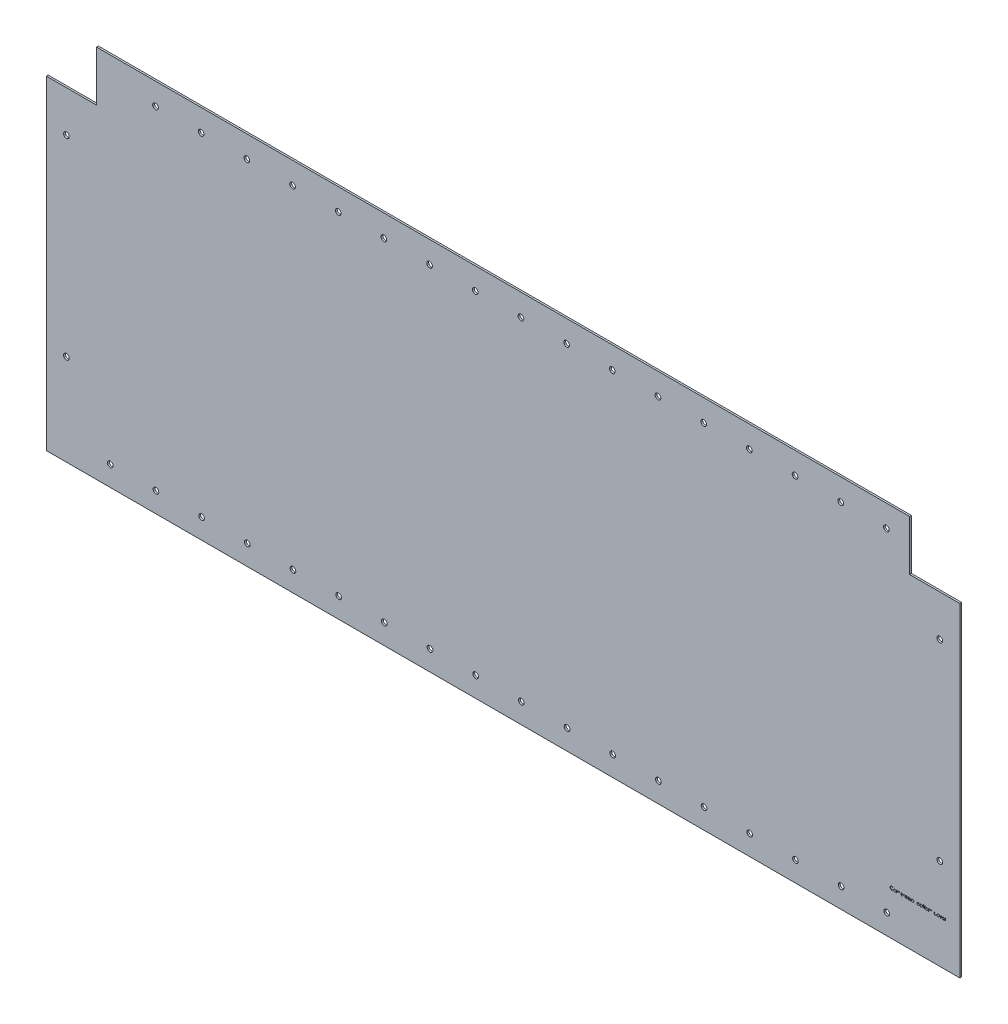
from build123d import *

# Parameters (mm, degrees)
SKETCH1_W           = 1000
SKETCH1_H           = 410
SKETCH1_R           = 3.1
BOSS_EXTRUDE1_DEPTH = 2
SKETCH2_W           = 55
SKETCH2_H           = 55
CUT_EXTRUDE1_DEPTH  = 10
SKETCH3_R           = 3.1
CUT_EXTRUDE2_DEPTH  = 1081.788600976
SKETCH4_R           = 3.1
CUT_EXTRUDE3_DEPTH  = 1081.788600976
CUT_EXTRUDE4_DEPTH  = 1081.788600976


with BuildPart() as part:
    # Sketch1 → Boss-Extrude1 (new body)
    with BuildSketch(Plane.XY):
        with Locations((500, -205)):
            Rectangle(SKETCH1_W, SKETCH1_H)
        with Locations((22, -100)):
            Circle(SKETCH1_R, mode=Mode.SUBTRACT)
        with Locations((22, -310)):
            Circle(SKETCH1_R, mode=Mode.SUBTRACT)
        with Locations((978, -310)):
            Circle(SKETCH1_R, mode=Mode.SUBTRACT)
        with Locations((978, -100)):
            Circle(SKETCH1_R, mode=Mode.SUBTRACT)
    extrude(amount=BOSS_EXTRUDE1_DEPTH)

    # Sketch2 → Cut-Extrude1 (cut)
    with BuildSketch(Plane.XY.offset(2)):
        with Locations((972.5, -27.5)):
            Rectangle(SKETCH2_W, SKETCH2_H)
        with Locations((27.5, -27.5)):
            Rectangle(SKETCH2_W, SKETCH2_H)
    extrude(amount=-CUT_EXTRUDE1_DEPTH, mode=Mode.SUBTRACT)

    # Sketch3 → Cut-Extrude2 (cut, through all)
    with BuildSketch(Plane.XY.offset(2)):
        with Locations((70, -388)):
            Circle(SKETCH3_R)
        with Locations((120, -388)):
            Circle(SKETCH3_R)
        with Locations((170, -388)):
            Circle(SKETCH3_R)
        with Locations((220, -388)):
            Circle(SKETCH3_R)
        with Locations((270, -388)):
            Circle(SKETCH3_R)
        with Locations((320, -388)):
            Circle(SKETCH3_R)
        with Locations((370, -388)):
            Circle(SKETCH3_R)
        with Locations((420, -388)):
            Circle(SKETCH3_R)
        with Locations((470, -388)):
            Circle(SKETCH3_R)
        with Locations((520, -388)):
            Circle(SKETCH3_R)
        with Locations((570, -388)):
            Circle(SKETCH3_R)
        with Locations((620, -388)):
            Circle(SKETCH3_R)
        with Locations((670, -388)):
            Circle(SKETCH3_R)
        with Locations((720, -388)):
            Circle(SKETCH3_R)
        with Locations((770, -388)):
            Circle(SKETCH3_R)
        with Locations((820, -388)):
            Circle(SKETCH3_R)
        with Locations((870, -388)):
            Circle(SKETCH3_R)
        with Locations((920, -388)):
            Circle(SKETCH3_R)
    extrude(amount=-CUT_EXTRUDE2_DEPTH, mode=Mode.SUBTRACT)

    # Sketch4 → Cut-Extrude3 (cut, through all)
    with BuildSketch(Plane.XY.offset(2)):
        with Locations((119.549343865, -24)):
            Circle(SKETCH4_R)
        with Locations((169.549343865, -24)):
            Circle(SKETCH4_R)
        with Locations((219.549343865, -24)):
            Circle(SKETCH4_R)
        with Locations((269.549343865, -24)):
            Circle(SKETCH4_R)
        with Locations((319.549343865, -24)):
            Circle(SKETCH4_R)
        with Locations((369.549343865, -24)):
            Circle(SKETCH4_R)
        with Locations((419.549343865, -24)):
            Circle(SKETCH4_R)
        with Locations((469.549343865, -24)):
            Circle(SKETCH4_R)
        with Locations((519.549343865, -24)):
            Circle(SKETCH4_R)
        with Locations((569.549343865, -24)):
            Circle(SKETCH4_R)
        with Locations((619.549343865, -24)):
            Circle(SKETCH4_R)
        with Locations((669.549343865, -24)):
            Circle(SKETCH4_R)
        with Locations((719.549343865, -24)):
            Circle(SKETCH4_R)
        with Locations((769.549343865, -24)):
            Circle(SKETCH4_R)
        with Locations((819.549343865, -24)):
            Circle(SKETCH4_R)
        with Locations((869.549343865, -24)):
            Circle(SKETCH4_R)
        with Locations((919.549343865, -24)):
            Circle(SKETCH4_R)
    extrude(amount=-CUT_EXTRUDE3_DEPTH, mode=Mode.SUBTRACT)

    # Sketch5 → Cut-Extrude4 (cut, through all)
    # profile 1 of 21: a face of its own
    with BuildSketch(Plane.XY.offset(2)):
        with BuildLine():
            Line((926.994334839, -361.033624605), (926.719495095, -361.243961143))
            add(Edge.make_bspline(
                [(926.719495095, -361.243961143), (926.681244167, -361.196991344), (926.620622754, -361.129785009), (926.532969737, -361.047942332), (926.46506477, -360.990689183), (926.393301885, -360.939275531), (926.319442085, -360.891003172), (926.242243785, -360.847737381), (926.13549207, -360.795265605), (925.995844708, -360.740586633), (925.75837223, -360.678198046), (925.57282796, -360.66001987), (925.44766016, -360.66062781)],
                knots=[0, 0, 0, 0, 0.125474941, 0.18712122, 0.248294346, 0.309294856, 0.369850066, 0.430973376, 0.49245599, 0.616147966, 0.740843698, 1, 1, 1, 1], degree=3))
            add(Edge.make_bspline(
                [(925.44766016, -360.66062781), (925.377778709, -360.659707858), (925.273795742, -360.667206417), (925.137374986, -360.687383701), (925.037662704, -360.709474238), (924.940079964, -360.737456186), (924.843987504, -360.770879113), (924.75077692, -360.812234623), (924.659158677, -360.857942701), (924.571379467, -360.909570194), (924.488324419, -360.965883534), (924.410296452, -361.026252633), (924.337233839, -361.090903739), (924.269061892, -361.1595457), (924.206274578, -361.232910041), (924.149089179, -361.310762215), (924.09637211, -361.392075622), (924.049159542, -361.476613416), (924.00962905, -361.564688476), (923.974626215, -361.65479262), (923.946918318, -361.747943625), (923.925026422, -361.843486977), (923.904496197, -361.975657992), (923.897327672, -362.076663663), (923.898180993, -362.14490265)],
                knots=[0, 0, 0, 0, 0.087501875, 0.130462627, 0.172752021, 0.215403067, 0.25764983, 0.300152749, 0.34312149, 0.385925163, 0.427685727, 0.46881795, 0.5094918, 0.549883031, 0.589980023, 0.63040523, 0.670868626, 0.711383944, 0.751627258, 0.791775577, 0.832458919, 0.873319045, 0.914542956, 1, 1, 1, 1], degree=3))
            add(Edge.make_bspline(
                [(923.898180993, -362.14490265), (923.897715111, -362.246504316), (923.911867, -362.396555804), (923.95751837, -362.589492321), (924.007677333, -362.724872819), (924.06961149, -362.854781001), (924.147848012, -362.977019907), (924.238465672, -363.093436439), (924.342739781, -363.201279465), (924.457145681, -363.299792909), (924.579893572, -363.386544522), (924.710677859, -363.458855598), (924.84805451, -363.519045866), (924.99308054, -363.565247812), (925.199755158, -363.609692146), (925.360429997, -363.623042905), (925.469394935, -363.622166272)],
                knots=[0, 0, 0, 0, 0.126290104, 0.186726469, 0.246146432, 0.305575643, 0.365429386, 0.426326309, 0.488839906, 0.551724972, 0.613918596, 0.675483766, 0.737333897, 0.800229044, 0.864502298, 1, 1, 1, 1], degree=3))
            add(Edge.make_bspline(
                [(925.469394935, -363.622166272), (925.589569141, -363.622199599), (925.768070241, -363.605250758), (925.995965095, -363.543282313), (926.157287386, -363.479459433), (926.310579367, -363.396343006), (926.508155531, -363.260030381), (926.638784696, -363.131664256), (926.719495095, -363.038832938)],
                knots=[0, 0, 0, 0, 0.252948636, 0.374754734, 0.495939754, 0.617180641, 0.740909469, 1, 1, 1, 1], degree=3))
            Line((926.719495095, -363.038832938), (926.994334839, -363.247066111))
            add(Edge.make_bspline(
                [(926.994334839, -363.247066111), (926.951031593, -363.304612571), (926.882202197, -363.387290525), (926.781337787, -363.488310727), (926.701699023, -363.55845077), (926.618576673, -363.624601894), (926.530505587, -363.684904626), (926.438636222, -363.740195258), (926.343281834, -363.790822285), (926.244543195, -363.835739374), (926.142538774, -363.874193672), (926.037708169, -363.907316576), (925.930046766, -363.934576064), (925.819330609, -363.955818496), (925.666514636, -363.975133971), (925.549960105, -363.981710769), (925.471498301, -363.981140631)],
                knots=[0, 0, 0, 0, 0.123053062, 0.183475001, 0.243726501, 0.304278917, 0.364862921, 0.425946204, 0.48739123, 0.549220384, 0.611143589, 0.67352853, 0.736961457, 0.800785283, 0.866012596, 1, 1, 1, 1], degree=3))
            add(Edge.make_bspline(
                [(925.471498301, -363.981140631), (925.39703309, -363.982068804), (925.286948899, -363.976097152), (925.142531062, -363.960496563), (925.038755868, -363.9432843), (924.937630041, -363.922932709), (924.840069416, -363.89566334), (924.745114223, -363.865113674), (924.653145853, -363.82920884), (924.564086251, -363.788692539), (924.478222081, -363.742901299), (924.395594985, -363.692218278), (924.315384578, -363.637767572), (924.238805675, -363.577774148), (924.1399337, -363.491131209), (924.070969024, -363.419712051), (924.027888525, -363.369061304)],
                knots=[0, 0, 0, 0, 0.137749562, 0.203916744, 0.268779862, 0.332413706, 0.39475354, 0.456180032, 0.516995649, 0.577395938, 0.637198344, 0.696999184, 0.756756194, 0.816553905, 0.876947997, 1, 1, 1, 1], degree=3))
            add(Edge.make_bspline(
                [(924.027888525, -363.369061304), (923.955354664, -363.284322899), (923.857877496, -363.148535053), (923.754773227, -362.95217963), (923.692339573, -362.798797303), (923.643643604, -362.638759621), (923.597669059, -362.413305066), (923.583730208, -362.238906637), (923.584078429, -362.121064509)],
                knots=[0, 0, 0, 0, 0.247156016, 0.368779749, 0.490733862, 0.613613772, 0.738957576, 1, 1, 1, 1], degree=3))
            add(Edge.make_bspline(
                [(923.584078429, -362.121064509), (923.584015504, -361.997262329), (923.599708701, -361.813762704), (923.656555766, -361.578321879), (923.715892201, -361.412119272), (923.791213627, -361.25298869), (923.884235879, -361.102147562), (923.993904217, -360.95863076), (924.119351454, -360.824615937), (924.256918873, -360.702076875), (924.404237685, -360.594269611), (924.561019559, -360.504556004), (924.725537705, -360.429545193), (924.899022263, -360.371956297), (925.145596064, -360.317022121), (925.337488289, -360.301905641), (925.46729157, -360.301653451)],
                knots=[0, 0, 0, 0, 0.127013532, 0.18795481, 0.248013913, 0.307747682, 0.368234515, 0.429469844, 0.492743437, 0.556257769, 0.618216786, 0.679655476, 0.741245546, 0.803415265, 0.866815462, 1, 1, 1, 1], degree=3))
            add(Edge.make_bspline(
                [(925.46729157, -360.301653451), (925.546870586, -360.30150256), (925.664994008, -360.306907252), (925.819501851, -360.327926789), (925.931112413, -360.349021267), (926.040235139, -360.375234258), (926.146035352, -360.409373056), (926.249134042, -360.448409988), (926.348880966, -360.493368339), (926.444797453, -360.543835144), (926.536854003, -360.599250627), (926.624318013, -360.659546923), (926.707809985, -360.724208301), (926.785914538, -360.794613569), (926.886166123, -360.893752375), (926.952141889, -360.976897293), (926.994334839, -361.033624605)],
                knots=[0, 0, 0, 0, 0.135682946, 0.20121499, 0.265682235, 0.329266835, 0.392395428, 0.455069762, 0.51712685, 0.578790035, 0.639739863, 0.700191504, 0.759806243, 0.819628319, 0.879354791, 1, 1, 1, 1], degree=3))
        make_face()
    # profile 2 of 21: a face of its own
    with BuildSketch(Plane.XY.offset(2)):
        with BuildLine():
            Line((930.808437403, -361.333704733), (931.122539967, -361.333704733))
            Line((931.122539967, -361.333704733), (931.122539967, -361.778215951))
            add(Edge.make_bspline(
                [(931.122539967, -361.778215951), (931.175225402, -361.702767909), (931.281611858, -361.569890338), (931.411621179, -361.45976079), (931.477307595, -361.41854047)],
                knots=[0, 0, 0, 0, 0.543394841, 1, 1, 1, 1], degree=3))
            add(Edge.make_bspline(
                [(931.477307595, -361.41854047), (931.558896819, -361.376410836), (931.730712393, -361.309725916), (931.913845902, -361.289528575), (932.004551185, -361.288832938)],
                knots=[0, 0, 0, 0, 0.50303512, 1, 1, 1, 1], degree=3))
            add(Edge.make_bspline(
                [(932.004551185, -361.288832938), (932.065611381, -361.289619292), (932.157235573, -361.297371435), (932.275023689, -361.328693948), (932.359636183, -361.361074761), (932.439357188, -361.400328442), (932.512446578, -361.446376319), (932.578069756, -361.498074088), (932.636199682, -361.55775201), (932.688453167, -361.627092217), (932.756201504, -361.740858362), (932.795005032, -361.837907947), (932.818553589, -361.90652124)],
                knots=[0, 0, 0, 0, 0.16653232, 0.248836331, 0.331246145, 0.412957109, 0.490494278, 0.566155792, 0.639987335, 0.716765488, 0.802143905, 1, 1, 1, 1], degree=3))
            add(Edge.make_bspline(
                [(932.818553589, -361.90652124), (932.844675993, -361.857408302), (932.887704188, -361.787006703), (932.952033042, -361.699884504), (933.002051222, -361.639869327), (933.054480039, -361.584562017), (933.10954035, -361.533764946), (933.166925388, -361.487267026), (933.246717684, -361.432933423), (933.350529246, -361.375308584), (933.525098347, -361.308176571), (933.664291839, -361.288610719), (933.756654551, -361.288832938)],
                knots=[0, 0, 0, 0, 0.141225536, 0.209115852, 0.274839653, 0.33948293, 0.402476267, 0.464941889, 0.526832641, 0.647414816, 0.765561512, 1, 1, 1, 1], degree=3))
            add(Edge.make_bspline(
                [(933.756654551, -361.288832938), (933.840319227, -361.289453455), (933.965334837, -361.303167193), (934.119582258, -361.36118559), (934.225054286, -361.419369535), (934.320215442, -361.492561935), (934.402931394, -361.579627243), (934.47270185, -361.679970835), (934.518280485, -361.774362578), (934.549195707, -361.857697946), (934.568257102, -361.92870423), (934.585096111, -362.006855783), (934.599080255, -362.092246053), (934.609286698, -362.185176621), (934.619812062, -362.323721413), (934.622929882, -362.431617377), (934.622539967, -362.505980374)],
                knots=[0, 0, 0, 0, 0.147965015, 0.218796999, 0.289470445, 0.359724218, 0.429707739, 0.50049652, 0.57442902, 0.613947296, 0.65715527, 0.70397277, 0.754938985, 0.809706611, 0.868832954, 1, 1, 1, 1], degree=3))
            Line((934.622539967, -362.505980374), (934.622539967, -363.891397041))
            Line((934.622539967, -363.891397041), (934.308437403, -363.891397041))
            Line((934.308437403, -363.891397041), (934.308437403, -362.504578131))
            add(Edge.make_bspline(
                [(934.308437403, -362.504578131), (934.30850874, -362.441708507), (934.307548211, -362.351382899), (934.300438236, -362.236452609), (934.29450686, -362.162280732), (934.286262312, -362.096031896), (934.275616545, -362.037839486), (934.26433883, -361.987245679), (934.245602846, -361.931159607), (934.21565496, -361.869289569), (934.170037444, -361.80256529), (934.112567477, -361.744487136), (934.046206774, -361.69405848), (933.97066045, -361.653104917), (933.856805539, -361.612863843), (933.764473085, -361.602534991), (933.701967051, -361.602935502)],
                knots=[0, 0, 0, 0, 0.150563303, 0.216151057, 0.275679792, 0.32870705, 0.375904435, 0.417301898, 0.452692748, 0.517265292, 0.581216568, 0.645321894, 0.712024493, 0.780130045, 0.850218226, 1, 1, 1, 1], degree=3))
            add(Edge.make_bspline(
                [(933.701967051, -361.602935502), (933.623429869, -361.601589435), (933.506427659, -361.620870408), (933.35947996, -361.67887498), (933.257261929, -361.741217948), (933.163234922, -361.816050514), (933.082335137, -361.904993708), (933.015503008, -362.005625375), (932.970249017, -362.098771643), (932.94165972, -362.182441149), (932.922782794, -362.255538512), (932.908099447, -362.338620056), (932.894328723, -362.431127673), (932.885341833, -362.533697303), (932.873976683, -362.689685092), (932.873019791, -362.811914451), (932.872539967, -362.896505214)],
                knots=[0, 0, 0, 0, 0.134706602, 0.201864998, 0.270788266, 0.340024294, 0.408082739, 0.476813195, 0.547346064, 0.585639795, 0.628864953, 0.677153203, 0.730802811, 0.789806616, 0.854325009, 1, 1, 1, 1], degree=3))
            Line((932.872539967, -362.896505214), (932.872539967, -363.891397041))
            Line((932.872539967, -363.891397041), (932.558437403, -363.891397041))
            Line((932.558437403, -363.891397041), (932.558437403, -362.590816111))
            add(Edge.make_bspline(
                [(932.558437403, -362.590816111), (932.558493619, -362.520235877), (932.557568916, -362.418934515), (932.550439728, -362.290213613), (932.544562232, -362.207392354), (932.536101365, -362.13398098), (932.526491754, -362.06958623), (932.515143111, -362.014369483), (932.496353232, -361.953806075), (932.467638778, -361.887085306), (932.421450446, -361.815943667), (932.36384313, -361.753677875), (932.29627124, -361.700510269), (932.220269452, -361.656602795), (932.105890953, -361.613313921), (932.012532803, -361.603462669), (931.949863685, -361.602935502)],
                knots=[0, 0, 0, 0, 0.158778855, 0.227738062, 0.289945653, 0.345498839, 0.393896337, 0.436373785, 0.472122274, 0.536383616, 0.599077902, 0.661948234, 0.726310542, 0.791771103, 0.858647304, 1, 1, 1, 1], degree=3))
            add(Edge.make_bspline(
                [(931.949863685, -361.602935502), (931.874055762, -361.602302989), (931.760119829, -361.620501874), (931.617295613, -361.678038902), (931.515339955, -361.737616564), (931.42166607, -361.811538076), (931.33965773, -361.898446995), (931.270715233, -361.997297649), (931.22498338, -362.089461758), (931.195484981, -362.171035094), (931.175889384, -362.240386019), (931.159050894, -362.317386309), (931.146532059, -362.402273262), (931.134471841, -362.494495013), (931.126278801, -362.633022061), (931.121544112, -362.740761305), (931.122539967, -362.815175086)],
                knots=[0, 0, 0, 0, 0.136870959, 0.206114357, 0.277538182, 0.349771978, 0.421250836, 0.492910757, 0.567026589, 0.606614153, 0.649703954, 0.69730315, 0.74908566, 0.804880647, 0.865485006, 1, 1, 1, 1], degree=3))
            Line((931.122539967, -362.815175086), (931.122539967, -363.891397041))
            Line((931.122539967, -363.891397041), (930.808437403, -363.891397041))
            Line((930.808437403, -363.891397041), (930.808437403, -361.333704733))
        make_face()
    # profile 3 of 21: a face of its own
    with BuildSketch(Plane.XY.offset(2)):
        with BuildLine():
            Line((935.340488685, -361.333704733), (935.654591249, -361.333704733))
            Line((935.654591249, -361.333704733), (935.654591249, -361.806961945))
            add(Edge.make_bspline(
                [(935.654591249, -361.806961945), (935.716756485, -361.721652497), (935.821184177, -361.605718918), (935.982462255, -361.481547677), (936.109578026, -361.410118113), (936.244011233, -361.356354356), (936.435246393, -361.302205154), (936.586324111, -361.289154385), (936.688044775, -361.288832938)],
                knots=[0, 0, 0, 0, 0.263044683, 0.386061082, 0.505770653, 0.625178031, 0.746147722, 1, 1, 1, 1], degree=3))
            add(Edge.make_bspline(
                [(936.688044775, -361.288832938), (936.777677506, -361.289731061), (936.910961124, -361.299690799), (937.082395218, -361.34045882), (937.203961577, -361.383826324), (937.321225093, -361.43749071), (937.432447075, -361.50520533), (937.539360649, -361.583612188), (937.639276887, -361.673844156), (937.731598038, -361.771472463), (937.811445008, -361.876494787), (937.88031407, -361.985457258), (937.935994786, -362.100049785), (937.979564175, -362.219367386), (938.021538409, -362.387112865), (938.032283303, -362.517719051), (938.032796377, -362.605539669)],
                knots=[0, 0, 0, 0, 0.128636051, 0.190652902, 0.252125037, 0.313446276, 0.375227279, 0.438498083, 0.5032851, 0.568009687, 0.630878982, 0.692153504, 0.75255215, 0.813191094, 0.8739854, 1, 1, 1, 1], degree=3))
            add(Edge.make_bspline(
                [(938.032796377, -362.605539669), (938.032593138, -362.695048919), (938.021072325, -362.827736124), (937.980417956, -362.998456827), (937.937403152, -363.11973349), (937.881750035, -363.235717301), (937.814048621, -363.346323658), (937.73416129, -363.451517357), (937.642860401, -363.549870316), (937.543807406, -363.640469398), (937.437929912, -363.719708304), (937.326871059, -363.786246639), (937.211198612, -363.84184076), (937.089924024, -363.883691142), (936.919636898, -363.924641927), (936.787108091, -363.935946119), (936.69786048, -363.936268836)],
                knots=[0, 0, 0, 0, 0.128034164, 0.189573725, 0.250579835, 0.311733221, 0.37325008, 0.435762516, 0.500345561, 0.564949367, 0.627527909, 0.68915729, 0.749865012, 0.8107602, 0.872299761, 1, 1, 1, 1], degree=3))
            add(Edge.make_bspline(
                [(936.69786048, -363.936268836), (936.597390272, -363.937428749), (936.448886477, -363.920265555), (936.258562098, -363.867700243), (936.124360577, -363.811082274), (935.996228245, -363.738780284), (935.831165186, -363.619280177), (935.722132579, -363.508094811), (935.654591249, -363.427955534)],
                knots=[0, 0, 0, 0, 0.250547782, 0.371230204, 0.49211577, 0.613400988, 0.73799732, 1, 1, 1, 1], degree=3))
            Line((935.654591249, -363.427955534), (935.654591249, -364.833704733))
            Line((935.654591249, -364.833704733), (935.340488685, -364.833704733))
            Line((935.340488685, -364.833704733), (935.340488685, -361.333704733))
        make_face()
        with BuildLine():
            add(Edge.make_bspline(
                [(936.685240288, -361.602935502), (936.615134638, -361.601902555), (936.51170789, -361.611973072), (936.378046989, -361.641583088), (936.283923902, -361.674450579), (936.193673587, -361.714861137), (936.107989338, -361.765339999), (936.026931805, -361.824992871), (935.950704721, -361.892671979), (935.881841605, -361.967246727), (935.820878039, -362.046834531), (935.769673071, -362.131334635), (935.727162396, -362.219960143), (935.694851663, -362.313404877), (935.663638459, -362.445576137), (935.654788292, -362.548632513), (935.654591249, -362.618159861)],
                knots=[0, 0, 0, 0, 0.130023749, 0.192374057, 0.253884304, 0.314896085, 0.375805828, 0.438242236, 0.501591268, 0.56488076, 0.626533341, 0.687515765, 0.748105916, 0.808795537, 0.870821519, 1, 1, 1, 1], degree=3))
            add(Edge.make_bspline(
                [(935.654591249, -362.618159861), (935.654758451, -362.708936733), (935.66988949, -362.844029346), (935.725917261, -363.013863552), (935.784387873, -363.131322677), (935.858350916, -363.239305728), (935.947444923, -363.335997379), (936.050888561, -363.420783459), (936.166955646, -363.492222351), (936.291377065, -363.550143936), (936.464529005, -363.605852145), (936.600016781, -363.621996707), (936.69014814, -363.622166272)],
                knots=[0, 0, 0, 0, 0.169344011, 0.251060671, 0.332326431, 0.413189279, 0.494299499, 0.57665388, 0.661784919, 0.74776493, 0.831967435, 1, 1, 1, 1], degree=3))
            add(Edge.make_bspline(
                [(936.69014814, -363.622166272), (936.778628954, -363.622702564), (936.910802184, -363.604806378), (937.079726709, -363.549876571), (937.199908789, -363.490394523), (937.312731472, -363.417383575), (937.414614312, -363.329829019), (937.503616837, -363.228337861), (937.57949784, -363.115328703), (937.640567622, -362.994157159), (937.701820591, -362.82773356), (937.717689109, -362.69586682), (937.718693813, -362.609045278)],
                knots=[0, 0, 0, 0, 0.165573796, 0.248158777, 0.332033307, 0.416257349, 0.49952535, 0.58303856, 0.668595904, 0.75403535, 0.8369197, 1, 1, 1, 1], degree=3))
            add(Edge.make_bspline(
                [(937.718693813, -362.609045278), (937.719925348, -362.521524965), (937.700323563, -362.39060426), (937.642822358, -362.223173758), (937.580354344, -362.103649775), (937.506128538, -361.9908769), (937.416387916, -361.891321678), (937.315770197, -361.804155178), (937.203080803, -361.732124254), (937.082142844, -361.674896846), (936.911115833, -361.618347727), (936.775741712, -361.603330477), (936.685240288, -361.602935502)],
                knots=[0, 0, 0, 0, 0.163349297, 0.245826474, 0.33036716, 0.415198374, 0.497940932, 0.580476126, 0.663740011, 0.747512837, 0.830398741, 1, 1, 1, 1], degree=3))
        make_face(mode=Mode.SUBTRACT)
    # profile 4 of 21: a face of its own
    with BuildSketch(Plane.XY.offset(2)):
        with BuildLine():
            Line((938.571257916, -361.333704733), (938.88536048, -361.333704733))
            Line((938.88536048, -361.333704733), (938.88536048, -361.710207137))
            add(Edge.make_bspline(
                [(938.88536048, -361.710207137), (938.928380608, -361.642493178), (938.99633281, -361.548725494), (939.102129704, -361.446034433), (939.179765567, -361.387506153), (939.260146597, -361.343745814), (939.36771989, -361.301068605), (939.453278485, -361.289221955), (939.509358877, -361.288832938)],
                knots=[0, 0, 0, 0, 0.306112383, 0.438366514, 0.560541455, 0.675317225, 0.786113634, 1, 1, 1, 1], degree=3))
            add(Edge.make_bspline(
                [(939.509358877, -361.288832938), (939.55433533, -361.289182359), (939.650802161, -361.30607536), (939.738455272, -361.349613272), (939.782796377, -361.376473163)],
                knots=[0, 0, 0, 0, 0.463523195, 1, 1, 1, 1], degree=3))
            Line((939.782796377, -361.376473163), (939.610320416, -361.648508419))
            add(Edge.make_bspline(
                [(939.610320416, -361.648508419), (939.581707378, -361.635838085), (939.53023472, -361.612582447), (939.474447565, -361.603257891), (939.449763525, -361.602935502)],
                knots=[0, 0, 0, 0, 0.560229945, 1, 1, 1, 1], degree=3))
            add(Edge.make_bspline(
                [(939.449763525, -361.602935502), (939.3982385, -361.60286898), (939.31935925, -361.621746662), (939.224416137, -361.678581975), (939.166241682, -361.726766934), (939.121199873, -361.773327467), (939.089059447, -361.813973055), (939.05957717, -361.859552573), (939.031405131, -361.909281649), (939.005746198, -361.964013094), (938.972894758, -362.045067939), (938.953373371, -362.109545819), (938.941450224, -362.154017233)],
                knots=[0, 0, 0, 0, 0.191338128, 0.295190617, 0.410312337, 0.471930251, 0.536425159, 0.603118728, 0.674117672, 0.749332023, 0.828283384, 1, 1, 1, 1], degree=3))
            add(Edge.make_bspline(
                [(938.941450224, -362.154017233), (938.929700404, -362.198675067), (938.918236451, -362.273847129), (938.906012691, -362.383586511), (938.898864524, -362.486523135), (938.892311373, -362.603138871), (938.887037094, -362.786394449), (938.884814023, -362.930841059), (938.88536048, -363.03182172)],
                knots=[0, 0, 0, 0, 0.15693815, 0.258600395, 0.37589093, 0.508166168, 0.656237809, 1, 1, 1, 1], degree=3))
            Line((938.88536048, -363.03182172), (938.88536048, -363.891397041))
            Line((938.88536048, -363.891397041), (938.571257916, -363.891397041))
            Line((938.571257916, -363.891397041), (938.571257916, -361.333704733))
        make_face()
    # profile 5 of 21: a face of its own
    with BuildSketch(Plane.XY.offset(2)):
        with BuildLine():
            Line((942.196057595, -363.083704733), (942.47510407, -363.230239188))
            add(Edge.make_bspline(
                [(942.47510407, -363.230239188), (942.433603234, -363.307931823), (942.364132243, -363.416927709), (942.257186359, -363.546689863), (942.172113366, -363.628436281), (942.08243576, -363.699683231), (941.987705173, -363.762022748), (941.887415858, -363.81513883), (941.781566041, -363.859899522), (941.669267392, -363.894277756), (941.506884119, -363.927603455), (941.380007637, -363.936257676), (941.293713845, -363.936268836)],
                knots=[0, 0, 0, 0, 0.181660766, 0.265874227, 0.346354784, 0.424599862, 0.501903184, 0.579992091, 0.658443431, 0.738672236, 0.821894148, 1, 1, 1, 1], degree=3))
            add(Edge.make_bspline(
                [(941.293713845, -363.936268836), (941.197943165, -363.936229953), (941.05702147, -363.92523367), (940.877789627, -363.882087314), (940.754579575, -363.838161641), (940.639836896, -363.780724014), (940.533336152, -363.710767265), (940.434516607, -363.628634269), (940.346492361, -363.533618026), (940.267248642, -363.431936023), (940.197322223, -363.325980122), (940.138866964, -363.216017006), (940.091306385, -363.102746072), (940.052930988, -362.986883697), (940.016849703, -362.826436552), (940.008070079, -362.702584745), (940.007155352, -362.619562105)],
                knots=[0, 0, 0, 0, 0.139629225, 0.204796697, 0.268134963, 0.329813747, 0.391301398, 0.453433515, 0.51655169, 0.579631271, 0.641118921, 0.701294047, 0.760810336, 0.819931722, 0.878919575, 1, 1, 1, 1], degree=3))
            add(Edge.make_bspline(
                [(940.007155352, -362.619562105), (940.00810864, -362.541768403), (940.01538472, -362.425639543), (940.0470121, -362.275095832), (940.079159532, -362.16620814), (940.120738634, -362.06066789), (940.18891141, -361.923156854), (940.254075243, -361.827087583), (940.301626506, -361.765595759)],
                knots=[0, 0, 0, 0, 0.2537679, 0.377428427, 0.500550841, 0.623295883, 0.746578332, 1, 1, 1, 1], degree=3))
            add(Edge.make_bspline(
                [(940.301626506, -361.765595759), (940.362199566, -361.68987121), (940.460967541, -361.583989374), (940.615629693, -361.473226847), (940.737206716, -361.405187302), (940.867548151, -361.353554772), (941.054094177, -361.301060369), (941.201969974, -361.290031518), (941.301426185, -361.288832938)],
                knots=[0, 0, 0, 0, 0.253589335, 0.374643257, 0.495340042, 0.616324775, 0.739759335, 1, 1, 1, 1], degree=3))
            add(Edge.make_bspline(
                [(941.301426185, -361.288832938), (941.404253687, -361.288400965), (941.556161948, -361.30328117), (941.748755011, -361.35657042), (941.882599357, -361.411656052), (942.008268868, -361.482867799), (942.166544044, -361.601938584), (942.269986958, -361.711578274), (942.331374102, -361.792238387)],
                knots=[0, 0, 0, 0, 0.259032841, 0.381879824, 0.502258444, 0.62275219, 0.744742632, 1, 1, 1, 1], degree=3))
            add(Edge.make_bspline(
                [(942.331374102, -361.792238387), (942.377260754, -361.85112721), (942.437169794, -361.946766374), (942.500780562, -362.083552396), (942.53915734, -362.192434129), (942.570167473, -362.30626048), (942.600768956, -362.468616598), (942.60812999, -362.594598938), (942.609719454, -362.679858579)],
                knots=[0, 0, 0, 0, 0.236254763, 0.356174434, 0.477249655, 0.601539871, 0.729618382, 1, 1, 1, 1], degree=3))
            Line((942.609719454, -362.679858579), (940.321257916, -362.679858579))
            add(Edge.make_bspline(
                [(940.321257916, -362.679858579), (940.32304664, -362.74610459), (940.331926987, -362.843960849), (940.362207518, -362.96917414), (940.393453282, -363.05625672), (940.431326197, -363.139186967), (940.477710293, -363.217348975), (940.533050287, -363.2903869), (940.594775865, -363.358954087), (940.663482995, -363.420014659), (940.735765725, -363.474667123), (940.812659327, -363.520470198), (940.89355728, -363.55765946), (940.978329555, -363.586730531), (941.09831162, -363.613796991), (941.191439871, -363.622515956), (941.254451025, -363.622166272)],
                knots=[0, 0, 0, 0, 0.134475588, 0.198391058, 0.260753477, 0.321829223, 0.383037238, 0.444653123, 0.507398011, 0.569825238, 0.630777641, 0.690928687, 0.750945133, 0.811049477, 0.872330853, 1, 1, 1, 1], degree=3))
            add(Edge.make_bspline(
                [(941.254451025, -363.622166272), (941.316644929, -363.622467102), (941.409941161, -363.615144041), (941.531789455, -363.589624459), (941.621050198, -363.563766182), (941.70662101, -363.532180952), (941.785866908, -363.494080439), (941.858745852, -363.451929297), (941.926867471, -363.403722939), (941.992919311, -363.344701614), (942.0864171, -363.239882683), (942.153532869, -363.150252217), (942.196057595, -363.083704733)],
                knots=[0, 0, 0, 0, 0.163878894, 0.24565874, 0.327725695, 0.408609961, 0.485749086, 0.559169056, 0.630268476, 0.705306028, 0.792064966, 1, 1, 1, 1], degree=3))
        make_face()
        with BuildLine():
            Line((940.35421064, -362.365756015), (942.29561689, -362.365756015))
            add(Edge.make_bspline(
                [(942.29561689, -362.365756015), (942.275743091, -362.285015001), (942.236127715, -362.171093737), (942.163656328, -362.034183802), (942.102070615, -361.948595249), (942.032242603, -361.872594286), (941.951600008, -361.806174027), (941.861163247, -361.746760873), (941.761404904, -361.696592021), (941.65576079, -361.653964533), (941.50795331, -361.61539861), (941.393994391, -361.601794506), (941.317551986, -361.602935502)],
                knots=[0, 0, 0, 0, 0.185231261, 0.267500523, 0.344400382, 0.419594869, 0.496890627, 0.576637919, 0.660267852, 0.745386615, 0.830040327, 1, 1, 1, 1], degree=3))
            add(Edge.make_bspline(
                [(941.317551986, -361.602935502), (941.255626629, -361.602783365), (941.163592736, -361.609480069), (941.045250569, -361.635207715), (940.960542742, -361.661143381), (940.879934438, -361.695769951), (940.774914412, -361.750185534), (940.704014369, -361.804428142), (940.658497499, -361.842719156)],
                knots=[0, 0, 0, 0, 0.259141276, 0.384161763, 0.505991952, 0.629098089, 0.750669123, 1, 1, 1, 1], degree=3))
            add(Edge.make_bspline(
                [(940.658497499, -361.842719156), (940.62361682, -361.87210167), (940.576410446, -361.92298384), (940.51968095, -361.99776311), (940.480318245, -362.060779813), (940.444259963, -362.129411408), (940.398041733, -362.230031254), (940.370644846, -362.310424173), (940.35421064, -362.365756015)],
                knots=[0, 0, 0, 0, 0.222580497, 0.338499871, 0.458708565, 0.585535346, 0.717517743, 1, 1, 1, 1], degree=3))
        make_face(mode=Mode.SUBTRACT)
    # profile 6 of 21: a face of its own
    with BuildSketch(Plane.XY.offset(2)):
        with BuildLine():
            Line((944.449463044, -361.65271515), (944.236322019, -361.872166272))
            add(Edge.make_bspline(
                [(944.236322019, -361.872166272), (944.201504698, -361.830637245), (944.1480357, -361.772693017), (944.070213625, -361.708698367), (944.015175002, -361.669726548), (943.959713581, -361.640321997), (943.887650673, -361.612076371), (943.831430161, -361.602968268), (943.794615288, -361.602935502)],
                knots=[0, 0, 0, 0, 0.305035505, 0.441308964, 0.565963227, 0.683525114, 0.79333413, 1, 1, 1, 1], degree=3))
            add(Edge.make_bspline(
                [(943.794615288, -361.602935502), (943.75096551, -361.602040759), (943.68585909, -361.616133761), (943.608536442, -361.65970028), (943.558364134, -361.705602228), (943.51592703, -361.758382772), (943.474239464, -361.837236632), (943.462407049, -361.903241652), (943.462283557, -361.947186304)],
                knots=[0, 0, 0, 0, 0.245900629, 0.36916603, 0.498510841, 0.628503866, 0.751028329, 1, 1, 1, 1], degree=3))
            add(Edge.make_bspline(
                [(943.462283557, -361.947186304), (943.462359073, -361.987551837), (943.478045217, -362.071695677), (943.522532471, -362.144728566), (943.54922266, -362.179257618)],
                knots=[0, 0, 0, 0, 0.479403194, 1, 1, 1, 1], degree=3))
            add(Edge.make_bspline(
                [(943.54922266, -362.179257618), (943.56520517, -362.200972106), (943.596414217, -362.230507127), (943.6419909, -362.270690831), (943.68527745, -362.302659743), (943.734045762, -362.336269646), (943.81089248, -362.383680874), (943.871085027, -362.420268281), (943.914507115, -362.442879413)],
                knots=[0, 0, 0, 0, 0.177559821, 0.28398236, 0.402216747, 0.53356848, 0.676120994, 1, 1, 1, 1], degree=3))
            add(Edge.make_bspline(
                [(943.914507115, -362.442879413), (943.967227043, -362.472009562), (944.043080326, -362.515887831), (944.136764612, -362.578718843), (944.198229538, -362.62337613), (944.252148118, -362.668546381), (944.313843635, -362.724748666), (944.352979501, -362.770557428), (944.375144134, -362.801853772)],
                knots=[0, 0, 0, 0, 0.307114592, 0.446213159, 0.574876072, 0.69415211, 0.80458118, 1, 1, 1, 1], degree=3))
            add(Edge.make_bspline(
                [(944.375144134, -362.801853772), (944.413198364, -362.859388003), (944.477275216, -362.98603915), (944.493333834, -363.127042538), (944.494334839, -363.197286464)],
                knots=[0, 0, 0, 0, 0.495235025, 1, 1, 1, 1], degree=3))
            add(Edge.make_bspline(
                [(944.494334839, -363.197286464), (944.493862937, -363.247014407), (944.488364915, -363.321088942), (944.465369849, -363.415821647), (944.442294496, -363.483515616), (944.41110517, -363.547474909), (944.374558704, -363.609311065), (944.330683426, -363.667687014), (944.280592151, -363.722525996), (944.225746634, -363.772611639), (944.167240488, -363.816635974), (944.10500171, -363.853208914), (944.039474705, -363.883479496), (943.970511827, -363.907527832), (943.872519625, -363.930179328), (943.796225126, -363.935918737), (943.74483564, -363.936268836)],
                knots=[0, 0, 0, 0, 0.127199133, 0.188597338, 0.248639515, 0.309524699, 0.370036991, 0.431889244, 0.495704286, 0.559519328, 0.62137158, 0.682397107, 0.743568482, 0.805498484, 0.868639701, 1, 1, 1, 1], degree=3))
            add(Edge.make_bspline(
                [(943.74483564, -363.936268836), (943.674575631, -363.936801855), (943.569376802, -363.924676114), (943.433817664, -363.885959077), (943.335422669, -363.846305488), (943.242417644, -363.796107605), (943.129176783, -363.716515947), (943.055833399, -363.643513571), (943.013565608, -363.589914669)],
                knots=[0, 0, 0, 0, 0.251723961, 0.377218688, 0.504693549, 0.631458239, 0.755401067, 1, 1, 1, 1], degree=3))
            Line((943.013565608, -363.589914669), (943.221798781, -363.352935502))
            add(Edge.make_bspline(
                [(943.221798781, -363.352935502), (943.259448702, -363.394830597), (943.317742046, -363.453520088), (943.403592904, -363.517005985), (943.46641583, -363.555669423), (943.530639605, -363.585401739), (943.61710134, -363.613319016), (943.684253657, -363.622381459), (943.728709839, -363.622166272)],
                knots=[0, 0, 0, 0, 0.285904172, 0.417171648, 0.540500744, 0.659237718, 0.775006098, 1, 1, 1, 1], degree=3))
            add(Edge.make_bspline(
                [(943.728709839, -363.622166272), (943.787918047, -363.622678702), (943.875737695, -363.607391474), (943.981442194, -363.555618719), (944.049486907, -363.501598872), (944.107310066, -363.438626615), (944.163446756, -363.344305308), (944.18056353, -363.263826339), (944.180232275, -363.210607778)],
                knots=[0, 0, 0, 0, 0.261895674, 0.387836045, 0.517686206, 0.644508654, 0.764718263, 1, 1, 1, 1], degree=3))
            add(Edge.make_bspline(
                [(944.180232275, -363.210607778), (944.180064924, -363.16663816), (944.16607339, -363.078347921), (944.121883816, -363.000568103), (944.093994294, -362.966617393)],
                knots=[0, 0, 0, 0, 0.500453315, 1, 1, 1, 1], degree=3))
            add(Edge.make_bspline(
                [(944.093994294, -362.966617393), (944.077147297, -362.946350164), (944.045947852, -362.916942015), (943.998042015, -362.878852599), (943.952924881, -362.846498993), (943.900925433, -362.812912277), (943.818269253, -362.764307387), (943.752643834, -362.727452601), (943.706273942, -362.702995599)],
                knots=[0, 0, 0, 0, 0.167461676, 0.272270023, 0.389550841, 0.520801368, 0.666263293, 1, 1, 1, 1], degree=3))
            add(Edge.make_bspline(
                [(943.706273942, -362.702995599), (943.655679725, -362.675028518), (943.582693085, -362.633341471), (943.493622936, -362.571672596), (943.434512489, -362.528770008), (943.382380251, -362.485326448), (943.324466525, -362.428961064), (943.286207412, -362.384904204), (943.265268333, -362.353836945)],
                knots=[0, 0, 0, 0, 0.305950213, 0.443775499, 0.572824362, 0.692154156, 0.802295707, 1, 1, 1, 1], degree=3))
            add(Edge.make_bspline(
                [(943.265268333, -362.353836945), (943.225999562, -362.297442151), (943.167625698, -362.169543663), (943.146909219, -362.030525571), (943.148180993, -361.959806496)],
                knots=[0, 0, 0, 0, 0.492590796, 1, 1, 1, 1], degree=3))
            add(Edge.make_bspline(
                [(943.148180993, -361.959806496), (943.148497782, -361.913664183), (943.152626232, -361.845029316), (943.173307401, -361.757454431), (943.192348513, -361.695329386), (943.218835134, -361.636826816), (943.250480073, -361.58116947), (943.28766776, -361.528433527), (943.330510979, -361.479430366), (943.377617645, -361.434921181), (943.428512405, -361.396122036), (943.482050679, -361.36301757), (943.538459039, -361.335245379), (943.598279739, -361.314270668), (943.683456744, -361.294527546), (943.749702226, -361.288298375), (943.794615288, -361.288832938)],
                knots=[0, 0, 0, 0, 0.133043535, 0.196507438, 0.258613417, 0.319728338, 0.380872854, 0.442635602, 0.505079304, 0.56788052, 0.628813854, 0.688910091, 0.748765006, 0.809385783, 0.870884336, 1, 1, 1, 1], degree=3))
            add(Edge.make_bspline(
                [(943.794615288, -361.288832938), (943.84951058, -361.288886127), (943.933393339, -361.300577395), (944.041288449, -361.339047961), (944.123617205, -361.379225884), (944.205405655, -361.431327661), (944.318912343, -361.518205364), (944.398854987, -361.595420582), (944.449463044, -361.65271515)],
                knots=[0, 0, 0, 0, 0.213411613, 0.32612673, 0.444451672, 0.56906108, 0.702712204, 1, 1, 1, 1], degree=3))
        make_face()
    # profile 7 of 21: a face of its own
    with BuildSketch(Plane.XY.offset(2)):
        with BuildLine():
            Line((946.334078429, -361.65271515), (946.120937403, -361.872166272))
            add(Edge.make_bspline(
                [(946.120937403, -361.872166272), (946.086120082, -361.830637245), (946.032651085, -361.772693017), (945.95482901, -361.708698367), (945.899790386, -361.669726548), (945.844328966, -361.640321997), (945.772266058, -361.612076371), (945.716045546, -361.602968268), (945.679230672, -361.602935502)],
                knots=[0, 0, 0, 0, 0.305035505, 0.441308964, 0.565963227, 0.683525114, 0.79333413, 1, 1, 1, 1], degree=3))
            add(Edge.make_bspline(
                [(945.679230672, -361.602935502), (945.635580894, -361.602040759), (945.570474474, -361.616133761), (945.493151826, -361.65970028), (945.442979519, -361.705602228), (945.400542414, -361.758382772), (945.358854849, -361.837236632), (945.347022434, -361.903241652), (945.346898942, -361.947186304)],
                knots=[0, 0, 0, 0, 0.245900629, 0.36916603, 0.498510841, 0.628503866, 0.751028329, 1, 1, 1, 1], degree=3))
            add(Edge.make_bspline(
                [(945.346898942, -361.947186304), (945.346974457, -361.987551837), (945.362660601, -362.071695677), (945.407147855, -362.144728566), (945.433838044, -362.179257618)],
                knots=[0, 0, 0, 0, 0.479403194, 1, 1, 1, 1], degree=3))
            add(Edge.make_bspline(
                [(945.433838044, -362.179257618), (945.449820554, -362.200972106), (945.481029602, -362.230507127), (945.526606285, -362.270690831), (945.569892834, -362.302659743), (945.618661147, -362.336269646), (945.695507865, -362.383680874), (945.755700412, -362.420268281), (945.799122499, -362.442879413)],
                knots=[0, 0, 0, 0, 0.177559821, 0.28398236, 0.402216747, 0.53356848, 0.676120994, 1, 1, 1, 1], degree=3))
            add(Edge.make_bspline(
                [(945.799122499, -362.442879413), (945.851842428, -362.472009562), (945.927695711, -362.515887831), (946.021379997, -362.578718843), (946.082844923, -362.62337613), (946.136763503, -362.668546381), (946.19845902, -362.724748666), (946.237594886, -362.770557428), (946.259759519, -362.801853772)],
                knots=[0, 0, 0, 0, 0.307114592, 0.446213159, 0.574876072, 0.69415211, 0.80458118, 1, 1, 1, 1], degree=3))
            add(Edge.make_bspline(
                [(946.259759519, -362.801853772), (946.297813748, -362.859388003), (946.3618906, -362.98603915), (946.377949219, -363.127042538), (946.378950224, -363.197286464)],
                knots=[0, 0, 0, 0, 0.495235025, 1, 1, 1, 1], degree=3))
            add(Edge.make_bspline(
                [(946.378950224, -363.197286464), (946.378478321, -363.247014407), (946.3729803, -363.321088942), (946.349985233, -363.415821647), (946.32690988, -363.483515616), (946.295720555, -363.547474909), (946.259174088, -363.609311065), (946.215298811, -363.667687014), (946.165207536, -363.722525996), (946.110362019, -363.772611639), (946.051855873, -363.816635974), (945.989617095, -363.853208914), (945.92409009, -363.883479496), (945.855127212, -363.907527832), (945.75713501, -363.930179328), (945.680840511, -363.935918737), (945.629451025, -363.936268836)],
                knots=[0, 0, 0, 0, 0.127199133, 0.188597338, 0.248639515, 0.309524699, 0.370036991, 0.431889244, 0.495704286, 0.559519328, 0.62137158, 0.682397107, 0.743568482, 0.805498484, 0.868639701, 1, 1, 1, 1], degree=3))
            add(Edge.make_bspline(
                [(945.629451025, -363.936268836), (945.559191015, -363.936801855), (945.453992186, -363.924676114), (945.318433049, -363.885959077), (945.220038053, -363.846305488), (945.127033029, -363.796107605), (945.013792167, -363.716515947), (944.940448784, -363.643513571), (944.898180993, -363.589914669)],
                knots=[0, 0, 0, 0, 0.251723961, 0.377218688, 0.504693549, 0.631458239, 0.755401067, 1, 1, 1, 1], degree=3))
            Line((944.898180993, -363.589914669), (945.106414166, -363.352935502))
            add(Edge.make_bspline(
                [(945.106414166, -363.352935502), (945.144064087, -363.394830597), (945.202357431, -363.453520088), (945.288208288, -363.517005985), (945.351031215, -363.555669423), (945.41525499, -363.585401739), (945.501716725, -363.613319016), (945.568869041, -363.622381459), (945.613325224, -363.622166272)],
                knots=[0, 0, 0, 0, 0.285904172, 0.417171648, 0.540500744, 0.659237718, 0.775006098, 1, 1, 1, 1], degree=3))
            add(Edge.make_bspline(
                [(945.613325224, -363.622166272), (945.672533431, -363.622678702), (945.760353079, -363.607391474), (945.866057579, -363.555618719), (945.934102291, -363.501598872), (945.99192545, -363.438626615), (946.048062141, -363.344305308), (946.065178915, -363.263826339), (946.06484766, -363.210607778)],
                knots=[0, 0, 0, 0, 0.261895674, 0.387836045, 0.517686206, 0.644508654, 0.764718263, 1, 1, 1, 1], degree=3))
            add(Edge.make_bspline(
                [(946.06484766, -363.210607778), (946.064680309, -363.16663816), (946.050688774, -363.078347921), (946.006499201, -363.000568103), (945.978609679, -362.966617393)],
                knots=[0, 0, 0, 0, 0.500453315, 1, 1, 1, 1], degree=3))
            add(Edge.make_bspline(
                [(945.978609679, -362.966617393), (945.961762681, -362.946350164), (945.930563237, -362.916942015), (945.882657399, -362.878852599), (945.837540266, -362.846498993), (945.785540817, -362.812912277), (945.702884637, -362.764307387), (945.637259219, -362.727452601), (945.590889326, -362.702995599)],
                knots=[0, 0, 0, 0, 0.167461676, 0.272270023, 0.389550841, 0.520801368, 0.666263293, 1, 1, 1, 1], degree=3))
            add(Edge.make_bspline(
                [(945.590889326, -362.702995599), (945.54029511, -362.675028518), (945.467308469, -362.633341471), (945.378238321, -362.571672596), (945.319127873, -362.528770008), (945.266995636, -362.485326448), (945.209081909, -362.428961064), (945.170822797, -362.384904204), (945.149883717, -362.353836945)],
                knots=[0, 0, 0, 0, 0.305950213, 0.443775499, 0.572824362, 0.692154156, 0.802295707, 1, 1, 1, 1], degree=3))
            add(Edge.make_bspline(
                [(945.149883717, -362.353836945), (945.110614947, -362.297442151), (945.052241083, -362.169543663), (945.031524604, -362.030525571), (945.032796377, -361.959806496)],
                knots=[0, 0, 0, 0, 0.492590796, 1, 1, 1, 1], degree=3))
            add(Edge.make_bspline(
                [(945.032796377, -361.959806496), (945.033113166, -361.913664183), (945.037241617, -361.845029316), (945.057922786, -361.757454431), (945.076963898, -361.695329386), (945.103450519, -361.636826816), (945.135095458, -361.58116947), (945.172283145, -361.528433527), (945.215126364, -361.479430366), (945.26223303, -361.434921181), (945.31312779, -361.396122036), (945.366666064, -361.36301757), (945.423074423, -361.335245379), (945.482895124, -361.314270668), (945.568072128, -361.294527546), (945.634317611, -361.288298375), (945.679230672, -361.288832938)],
                knots=[0, 0, 0, 0, 0.133043535, 0.196507438, 0.258613417, 0.319728338, 0.380872854, 0.442635602, 0.505079304, 0.56788052, 0.628813854, 0.688910091, 0.748765006, 0.809385783, 0.870884336, 1, 1, 1, 1], degree=3))
            add(Edge.make_bspline(
                [(945.679230672, -361.288832938), (945.734125964, -361.288886127), (945.818008724, -361.300577395), (945.925903834, -361.339047961), (946.008232589, -361.379225884), (946.09002104, -361.431327661), (946.203527727, -361.518205364), (946.283470372, -361.595420582), (946.334078429, -361.65271515)],
                knots=[0, 0, 0, 0, 0.213411613, 0.32612673, 0.444451672, 0.56906108, 0.702712204, 1, 1, 1, 1], degree=3))
        make_face()
    # profile 8 of 21: a face of its own
    with BuildSketch(Plane.XY.offset(2)):
        with BuildLine():
            Line((950.103309198, -361.333704733), (950.417411762, -361.333704733))
            Line((950.417411762, -361.333704733), (950.417411762, -361.710207137))
            add(Edge.make_bspline(
                [(950.417411762, -361.710207137), (950.46043189, -361.642493178), (950.528384093, -361.548725494), (950.634180986, -361.446034433), (950.711816849, -361.387506153), (950.79219788, -361.343745814), (950.899771172, -361.301068605), (950.985329767, -361.289221955), (951.04141016, -361.288832938)],
                knots=[0, 0, 0, 0, 0.306112383, 0.438366514, 0.560541455, 0.675317225, 0.786113634, 1, 1, 1, 1], degree=3))
            add(Edge.make_bspline(
                [(951.04141016, -361.288832938), (951.086386612, -361.289182359), (951.182853443, -361.30607536), (951.270506554, -361.349613272), (951.31484766, -361.376473163)],
                knots=[0, 0, 0, 0, 0.463523195, 1, 1, 1, 1], degree=3))
            Line((951.31484766, -361.376473163), (951.142371698, -361.648508419))
            add(Edge.make_bspline(
                [(951.142371698, -361.648508419), (951.11375866, -361.635838085), (951.062286002, -361.612582447), (951.006498847, -361.603257891), (950.981814807, -361.602935502)],
                knots=[0, 0, 0, 0, 0.560229945, 1, 1, 1, 1], degree=3))
            add(Edge.make_bspline(
                [(950.981814807, -361.602935502), (950.930289782, -361.60286898), (950.851410532, -361.621746662), (950.75646742, -361.678581975), (950.698292964, -361.726766934), (950.653251156, -361.773327467), (950.621110729, -361.813973055), (950.591628452, -361.859552573), (950.563456413, -361.909281649), (950.53779748, -361.964013094), (950.50494604, -362.045067939), (950.485424653, -362.109545819), (950.473501506, -362.154017233)],
                knots=[0, 0, 0, 0, 0.191338128, 0.295190617, 0.410312337, 0.471930251, 0.536425159, 0.603118728, 0.674117672, 0.749332023, 0.828283384, 1, 1, 1, 1], degree=3))
            add(Edge.make_bspline(
                [(950.473501506, -362.154017233), (950.461751686, -362.198675067), (950.450287733, -362.273847129), (950.438063973, -362.383586511), (950.430915806, -362.486523135), (950.424362655, -362.603138871), (950.419088376, -362.786394449), (950.416865305, -362.930841059), (950.417411762, -363.03182172)],
                knots=[0, 0, 0, 0, 0.15693815, 0.258600395, 0.37589093, 0.508166168, 0.656237809, 1, 1, 1, 1], degree=3))
            Line((950.417411762, -363.03182172), (950.417411762, -363.891397041))
            Line((950.417411762, -363.891397041), (950.103309198, -363.891397041))
            Line((950.103309198, -363.891397041), (950.103309198, -361.333704733))
        make_face()
    # profile 9 of 21: a face of its own
    with BuildSketch(Plane.XY.offset(2)):
        with BuildLine():
            Line((952.97510407, -363.891397041), (952.97510407, -360.301653451))
            Line((952.97510407, -360.301653451), (953.289206634, -360.301653451))
            Line((953.289206634, -360.301653451), (953.289206634, -361.797847361))
            add(Edge.make_bspline(
                [(953.289206634, -361.797847361), (953.356094891, -361.716670404), (953.46551609, -361.605299431), (953.630867956, -361.485696699), (953.758786434, -361.413064316), (953.89348763, -361.357855554), (954.083118419, -361.303100135), (954.232278442, -361.288750262), (954.332475865, -361.288832938)],
                knots=[0, 0, 0, 0, 0.262680826, 0.387189654, 0.508389693, 0.628966193, 0.749723188, 1, 1, 1, 1], degree=3))
            add(Edge.make_bspline(
                [(954.332475865, -361.288832938), (954.421723475, -361.289155655), (954.554252284, -361.300459847), (954.724539407, -361.341410633), (954.845814004, -361.38326101), (954.961486416, -361.438855149), (955.072545401, -361.505393417), (955.178422389, -361.584632582), (955.277477336, -361.675230661), (955.368770974, -361.773587345), (955.448684385, -361.87876765), (955.516180803, -361.989242723), (955.572024155, -362.104642864), (955.615150204, -362.225438918), (955.655560516, -362.395754363), (955.667335586, -362.528161177), (955.667411762, -362.61745874)],
                knots=[0, 0, 0, 0, 0.127821334, 0.189419252, 0.250372186, 0.311137475, 0.372825298, 0.435463182, 0.50012825, 0.564772537, 0.627344253, 0.688919446, 0.7498292, 0.810577905, 0.872175822, 1, 1, 1, 1], degree=3))
            add(Edge.make_bspline(
                [(955.667411762, -362.61745874), (955.667038976, -362.705539966), (955.655997651, -362.83653463), (955.614337419, -363.004846348), (955.570417122, -363.124493414), (955.515141227, -363.239513646), (955.44603293, -363.348593967), (955.366221106, -363.453632953), (955.273890184, -363.551256628), (955.173976579, -363.641489845), (955.067062318, -363.719896377), (954.955840515, -363.787611081), (954.838576951, -363.841275446), (954.717010606, -363.884642955), (954.545576507, -363.925410974), (954.412292891, -363.935370714), (954.32266016, -363.936268836)],
                knots=[0, 0, 0, 0, 0.126227996, 0.187288763, 0.247869473, 0.308511206, 0.369726883, 0.432535801, 0.49719823, 0.561923029, 0.62513307, 0.686854743, 0.748117091, 0.809530192, 0.871487485, 1, 1, 1, 1], degree=3))
            add(Edge.make_bspline(
                [(954.32266016, -363.936268836), (954.220953993, -363.935923802), (954.069834303, -363.922941322), (953.878665556, -363.868684063), (953.743941772, -363.815175679), (953.617550203, -363.742612551), (953.455133903, -363.620041692), (953.352396628, -363.502383314), (953.289206634, -363.418139829)],
                knots=[0, 0, 0, 0, 0.253879762, 0.37486255, 0.494282856, 0.614292714, 0.736970281, 1, 1, 1, 1], degree=3))
            Line((953.289206634, -363.418139829), (953.289206634, -363.891397041))
            Line((953.289206634, -363.891397041), (952.97510407, -363.891397041))
        make_face()
        with BuildLine():
            add(Edge.make_bspline(
                [(954.319855672, -363.622166272), (954.410356902, -363.621771166), (954.545731596, -363.606754301), (954.716757674, -363.550204555), (954.837698289, -363.492978932), (954.950377821, -363.420941382), (955.05103202, -363.33379939), (955.140505201, -363.23429651), (955.215182031, -363.122064111), (955.277415014, -363.002609371), (955.334835871, -362.835419657), (955.354679572, -362.704771831), (955.353309198, -362.61745874)],
                knots=[0, 0, 0, 0, 0.169735574, 0.252687118, 0.336526289, 0.419856114, 0.502456671, 0.585264756, 0.669799831, 0.754407469, 0.836949963, 1, 1, 1, 1], degree=3))
            add(Edge.make_bspline(
                [(955.353309198, -362.61745874), (955.352217412, -362.530201636), (955.336641347, -362.397794862), (955.275174134, -362.230946287), (955.214115638, -362.109772616), (955.138231592, -361.996764032), (955.049229864, -361.895272723), (954.947346811, -361.807718207), (954.834524185, -361.734707248), (954.71434209, -361.675225203), (954.545417571, -361.620295395), (954.413244337, -361.60239921), (954.324763525, -361.602935502)],
                knots=[0, 0, 0, 0, 0.163804915, 0.246617502, 0.331982974, 0.417466241, 0.500907145, 0.584103052, 0.668254172, 0.752056082, 0.83456956, 1, 1, 1, 1], degree=3))
            add(Edge.make_bspline(
                [(954.324763525, -361.602935502), (954.234440677, -361.602386028), (954.099286485, -361.620345596), (953.925822102, -361.675475875), (953.801532777, -361.734328489), (953.685679474, -361.806460849), (953.58206568, -361.891195731), (953.492738041, -361.987976818), (953.41917977, -362.096483083), (953.360829027, -362.213665096), (953.304107365, -362.382567052), (953.289647689, -362.517167956), (953.289206634, -362.607643034)],
                knots=[0, 0, 0, 0, 0.168181784, 0.252418528, 0.338617797, 0.424014102, 0.506401971, 0.587545174, 0.668800722, 0.750099527, 0.83102227, 1, 1, 1, 1], degree=3))
            add(Edge.make_bspline(
                [(953.289206634, -362.607643034), (953.28940366, -362.677170406), (953.298253876, -362.780226715), (953.329467002, -362.912398081), (953.361777947, -363.005842526), (953.404287836, -363.094469111), (953.455495765, -363.178965155), (953.516448049, -363.258568428), (953.585354461, -363.333083809), (953.661316896, -363.400892987), (953.742839979, -363.459672075), (953.828257995, -363.510283117), (953.918547661, -363.550639711), (954.012660101, -363.583521802), (954.146324867, -363.613126518), (954.24974919, -363.623200361), (954.319855672, -363.622166272)],
                knots=[0, 0, 0, 0, 0.129211511, 0.191253353, 0.251958493, 0.312564136, 0.373562153, 0.435230498, 0.498536174, 0.561901403, 0.62409808, 0.685023397, 0.746050779, 0.807576754, 0.869943004, 1, 1, 1, 1], degree=3))
        make_face(mode=Mode.SUBTRACT)
    # profile 10 of 21: a face of its own
    with BuildSketch(Plane.XY.offset(2)):
        Polygon((959.79561689, -360.301653451), (960.109719454, -360.301653451), (960.109719454, -361.333704733), (960.558437403, -361.333704733), (960.558437403, -361.647807297), (960.109719454, -361.647807297), (960.109719454, -363.891397041), (959.79561689, -363.891397041), (959.79561689, -361.647807297), (959.346898942, -361.647807297), (959.346898942, -361.333704733), (959.79561689, -361.333704733), align=None)
    # profile 11 of 21: a face of its own
    with BuildSketch(Plane.XY.offset(2)):
        Polygon((961.411001506, -360.301653451), (961.72510407, -360.301653451), (961.72510407, -361.333704733), (962.173822019, -361.333704733), (962.173822019, -361.647807297), (961.72510407, -361.647807297), (961.72510407, -363.891397041), (961.411001506, -363.891397041), (961.411001506, -361.647807297), (960.962283557, -361.647807297), (960.962283557, -361.333704733), (961.411001506, -361.333704733), align=None)
    # profile 12 of 21: a face of its own
    with BuildSketch(Plane.XY.offset(2)):
        with BuildLine():
            Line((965.898180993, -361.333704733), (966.212283557, -361.333704733))
            Line((966.212283557, -361.333704733), (966.212283557, -361.778215951))
            add(Edge.make_bspline(
                [(966.212283557, -361.778215951), (966.264968992, -361.702767909), (966.371355448, -361.569890338), (966.501364768, -361.45976079), (966.567051185, -361.41854047)],
                knots=[0, 0, 0, 0, 0.543394841, 1, 1, 1, 1], degree=3))
            add(Edge.make_bspline(
                [(966.567051185, -361.41854047), (966.648640409, -361.376410836), (966.820455983, -361.309725916), (967.003589492, -361.289528575), (967.094294775, -361.288832938)],
                knots=[0, 0, 0, 0, 0.50303512, 1, 1, 1, 1], degree=3))
            add(Edge.make_bspline(
                [(967.094294775, -361.288832938), (967.155354971, -361.289619292), (967.246979163, -361.297371435), (967.364767278, -361.328693948), (967.449379773, -361.361074761), (967.529100778, -361.400328442), (967.602190167, -361.446376319), (967.667813346, -361.498074088), (967.725943272, -361.55775201), (967.778196756, -361.627092217), (967.845945094, -361.740858362), (967.884748621, -361.837907947), (967.908297179, -361.90652124)],
                knots=[0, 0, 0, 0, 0.16653232, 0.248836331, 0.331246145, 0.412957109, 0.490494278, 0.566155792, 0.639987335, 0.716765488, 0.802143905, 1, 1, 1, 1], degree=3))
            add(Edge.make_bspline(
                [(967.908297179, -361.90652124), (967.934419583, -361.857408302), (967.977447778, -361.787006703), (968.041776632, -361.699884504), (968.091794811, -361.639869327), (968.144223628, -361.584562017), (968.19928394, -361.533764946), (968.256668977, -361.487267026), (968.336461274, -361.432933423), (968.440272836, -361.375308584), (968.614841937, -361.308176571), (968.754035429, -361.288610719), (968.84639814, -361.288832938)],
                knots=[0, 0, 0, 0, 0.141225536, 0.209115852, 0.274839653, 0.33948293, 0.402476267, 0.464941889, 0.526832641, 0.647414816, 0.765561512, 1, 1, 1, 1], degree=3))
            add(Edge.make_bspline(
                [(968.84639814, -361.288832938), (968.930062816, -361.289453455), (969.055078427, -361.303167193), (969.209325848, -361.36118559), (969.314797876, -361.419369535), (969.409959032, -361.492561935), (969.492674984, -361.579627243), (969.56244544, -361.679970835), (969.608024075, -361.774362578), (969.638939297, -361.857697946), (969.658000692, -361.92870423), (969.674839701, -362.006855783), (969.688823844, -362.092246053), (969.699030288, -362.185176621), (969.709555652, -362.323721413), (969.712673471, -362.431617377), (969.712283557, -362.505980374)],
                knots=[0, 0, 0, 0, 0.147965015, 0.218796999, 0.289470445, 0.359724218, 0.429707739, 0.50049652, 0.57442902, 0.613947296, 0.65715527, 0.70397277, 0.754938985, 0.809706611, 0.868832954, 1, 1, 1, 1], degree=3))
            Line((969.712283557, -362.505980374), (969.712283557, -363.891397041))
            Line((969.712283557, -363.891397041), (969.398180993, -363.891397041))
            Line((969.398180993, -363.891397041), (969.398180993, -362.504578131))
            add(Edge.make_bspline(
                [(969.398180993, -362.504578131), (969.398252329, -362.441708507), (969.397291801, -362.351382899), (969.390181826, -362.236452609), (969.384250449, -362.162280732), (969.376005901, -362.096031896), (969.365360135, -362.037839486), (969.354082419, -361.987245679), (969.335346436, -361.931159607), (969.30539855, -361.869289569), (969.259781034, -361.80256529), (969.202311067, -361.744487136), (969.135950363, -361.69405848), (969.060404039, -361.653104917), (968.946549129, -361.612863843), (968.854216675, -361.602534991), (968.79171064, -361.602935502)],
                knots=[0, 0, 0, 0, 0.150563303, 0.216151057, 0.275679792, 0.32870705, 0.375904435, 0.417301898, 0.452692748, 0.517265292, 0.581216568, 0.645321894, 0.712024493, 0.780130045, 0.850218226, 1, 1, 1, 1], degree=3))
            add(Edge.make_bspline(
                [(968.79171064, -361.602935502), (968.713173459, -361.601589435), (968.596171249, -361.620870408), (968.44922355, -361.67887498), (968.347005518, -361.741217948), (968.252978512, -361.816050514), (968.172078727, -361.904993708), (968.105246598, -362.005625375), (968.059992606, -362.098771643), (968.03140331, -362.182441149), (968.012526384, -362.255538512), (967.997843037, -362.338620056), (967.984072313, -362.431127673), (967.975085423, -362.533697303), (967.963720273, -362.689685092), (967.962763381, -362.811914451), (967.962283557, -362.896505214)],
                knots=[0, 0, 0, 0, 0.134706602, 0.201864998, 0.270788266, 0.340024294, 0.408082739, 0.476813195, 0.547346064, 0.585639795, 0.628864953, 0.677153203, 0.730802811, 0.789806616, 0.854325009, 1, 1, 1, 1], degree=3))
            Line((967.962283557, -362.896505214), (967.962283557, -363.891397041))
            Line((967.962283557, -363.891397041), (967.648180993, -363.891397041))
            Line((967.648180993, -363.891397041), (967.648180993, -362.590816111))
            add(Edge.make_bspline(
                [(967.648180993, -362.590816111), (967.648237209, -362.520235877), (967.647312506, -362.418934515), (967.640183318, -362.290213613), (967.634305822, -362.207392354), (967.625844955, -362.13398098), (967.616235344, -362.06958623), (967.604886701, -362.014369483), (967.586096822, -361.953806075), (967.557382368, -361.887085306), (967.511194036, -361.815943667), (967.45358672, -361.753677875), (967.386014829, -361.700510269), (967.310013042, -361.656602795), (967.195634542, -361.613313921), (967.102276392, -361.603462669), (967.039607275, -361.602935502)],
                knots=[0, 0, 0, 0, 0.158778855, 0.227738062, 0.289945653, 0.345498839, 0.393896337, 0.436373785, 0.472122274, 0.536383616, 0.599077902, 0.661948234, 0.726310542, 0.791771103, 0.858647304, 1, 1, 1, 1], degree=3))
            add(Edge.make_bspline(
                [(967.039607275, -361.602935502), (966.963799352, -361.602302989), (966.849863419, -361.620501874), (966.707039203, -361.678038902), (966.605083545, -361.737616564), (966.511409659, -361.811538076), (966.42940132, -361.898446995), (966.360458823, -361.997297649), (966.31472697, -362.089461758), (966.285228571, -362.171035094), (966.265632974, -362.240386019), (966.248794484, -362.317386309), (966.236275649, -362.402273262), (966.22421543, -362.494495013), (966.216022391, -362.633022061), (966.211287702, -362.740761305), (966.212283557, -362.815175086)],
                knots=[0, 0, 0, 0, 0.136870959, 0.206114357, 0.277538182, 0.349771978, 0.421250836, 0.492910757, 0.567026589, 0.606614153, 0.649703954, 0.69730315, 0.74908566, 0.804880647, 0.865485006, 1, 1, 1, 1], degree=3))
            Line((966.212283557, -362.815175086), (966.212283557, -363.891397041))
            Line((966.212283557, -363.891397041), (965.898180993, -363.891397041))
            Line((965.898180993, -363.891397041), (965.898180993, -361.333704733))
        make_face()
    # profile 13 of 21: a face of its own
    with BuildSketch(Plane.XY.offset(2)):
        with BuildLine():
            Line((974.289206634, -361.888292073), (974.026285961, -362.051653451))
            add(Edge.make_bspline(
                [(974.026285961, -362.051653451), (973.971998518, -361.979280942), (973.879293084, -361.881613055), (973.73712109, -361.7761571), (973.623890601, -361.712404398), (973.502493229, -361.663241618), (973.32707943, -361.615625714), (973.188784917, -361.602794605), (973.095196217, -361.602935502)],
                knots=[0, 0, 0, 0, 0.252584475, 0.373506483, 0.493364451, 0.614608597, 0.738470244, 1, 1, 1, 1], degree=3))
            add(Edge.make_bspline(
                [(973.095196217, -361.602935502), (973.0197791, -361.604033642), (972.907878167, -361.61061317), (972.764739892, -361.642740956), (972.66370163, -361.673873377), (972.56798057, -361.715628537), (972.477329818, -361.766436997), (972.390944299, -361.825487387), (972.311327505, -361.893897836), (972.238498733, -361.968296534), (972.175398968, -362.048050204), (972.120465099, -362.130770164), (972.077347958, -362.218521661), (972.042114331, -362.309298624), (972.010614359, -362.43806712), (972.000406522, -362.537975172), (972.000745095, -362.605539669)],
                knots=[0, 0, 0, 0, 0.136920982, 0.201969243, 0.26546155, 0.328247885, 0.390816717, 0.453550176, 0.517541982, 0.580738372, 0.641921509, 0.701596724, 0.76031288, 0.818756513, 0.87771808, 1, 1, 1, 1], degree=3))
            add(Edge.make_bspline(
                [(972.000745095, -362.605539669), (972.000988794, -362.694400977), (972.018381212, -362.828282504), (972.079161154, -362.99744712), (972.141147273, -363.119113717), (972.219643782, -363.231708042), (972.311811252, -363.332692361), (972.417731537, -363.420104754), (972.536464153, -363.492591381), (972.665219465, -363.550798836), (972.851140891, -363.607240908), (972.99822349, -363.621788419), (973.097299583, -363.622166272)],
                knots=[0, 0, 0, 0, 0.159965477, 0.240321361, 0.322528528, 0.405023583, 0.486596636, 0.567865474, 0.651332773, 0.736237567, 0.821529069, 1, 1, 1, 1], degree=3))
            add(Edge.make_bspline(
                [(973.097299583, -363.622166272), (973.188307318, -363.622112702), (973.323192422, -363.609428654), (973.494701163, -363.561500082), (973.615098956, -363.512410142), (973.728832407, -363.44883517), (973.873279794, -363.342832724), (973.969051561, -363.245572383), (974.026285961, -363.173448323)],
                knots=[0, 0, 0, 0, 0.255447312, 0.377298345, 0.498441779, 0.619372125, 0.741856502, 1, 1, 1, 1], degree=3))
            Line((974.026285961, -363.173448323), (974.289206634, -363.345924284))
            add(Edge.make_bspline(
                [(974.289206634, -363.345924284), (974.25886435, -363.392118592), (974.209409278, -363.458721523), (974.13433502, -363.539278287), (974.07435814, -363.595406823), (974.011270764, -363.64866211), (973.942944047, -363.696514433), (973.87157411, -363.741649042), (973.796325042, -363.782262006), (973.717974316, -363.818768175), (973.636632346, -363.85015987), (973.552652483, -363.877128007), (973.465936294, -363.898572897), (973.37631168, -363.915654861), (973.251755587, -363.93112769), (973.156600898, -363.937255353), (973.09239173, -363.936268836)],
                knots=[0, 0, 0, 0, 0.119068862, 0.178196546, 0.236956648, 0.295931988, 0.355855769, 0.416473305, 0.4777416, 0.53990299, 0.602537515, 0.665422385, 0.729765256, 0.794828771, 0.86182654, 1, 1, 1, 1], degree=3))
            add(Edge.make_bspline(
                [(973.09239173, -363.936268836), (972.995139734, -363.937253079), (972.851763981, -363.92498641), (972.667207193, -363.885423746), (972.537548565, -363.843911496), (972.414225403, -363.790393203), (972.297352261, -363.725039887), (972.187316268, -363.647287127), (972.085205406, -363.558524623), (971.991424248, -363.46228391), (971.910897029, -363.358434015), (971.841055458, -363.250792943), (971.784954307, -363.136983491), (971.740358232, -363.018517847), (971.698963757, -362.851209201), (971.686355346, -362.72133115), (971.686642531, -362.633584541)],
                knots=[0, 0, 0, 0, 0.136335251, 0.201095766, 0.264449955, 0.327004991, 0.389391387, 0.45197649, 0.515669983, 0.578973246, 0.640167029, 0.699739843, 0.758684985, 0.817820401, 0.876983987, 1, 1, 1, 1], degree=3))
            add(Edge.make_bspline(
                [(971.686642531, -362.633584541), (971.685777968, -362.573473503), (971.693454794, -362.484139868), (971.711049326, -362.366373917), (971.733039434, -362.280764538), (971.7584896, -362.196159692), (971.790962555, -362.113576471), (971.829058647, -362.03263183), (971.872310404, -361.953534092), (971.920999201, -361.877584555), (971.97488042, -361.805830889), (972.03192476, -361.737411124), (972.094800871, -361.674687363), (972.160840525, -361.615151173), (972.231912101, -361.560393046), (972.307607953, -361.510252064), (972.386791274, -361.463801014), (972.469415989, -361.42244171), (972.554982647, -361.386807983), (972.642975723, -361.356357239), (972.733535689, -361.332241385), (972.826062539, -361.312050232), (972.954441286, -361.294768591), (973.052242756, -361.288486362), (973.118333236, -361.288832938)],
                knots=[0, 0, 0, 0, 0.082135503, 0.122636035, 0.16283087, 0.203006601, 0.243526083, 0.284172936, 0.325409811, 0.366854666, 0.407550595, 0.448187374, 0.488682851, 0.529014965, 0.569842729, 0.611370238, 0.653237735, 0.695446119, 0.737751395, 0.780043361, 0.82280707, 0.865978142, 0.90959503, 1, 1, 1, 1], degree=3))
            add(Edge.make_bspline(
                [(973.118333236, -361.288832938), (973.201923681, -361.288572051), (973.326548482, -361.299023608), (973.489819463, -361.330443497), (973.607967447, -361.364972864), (973.720713525, -361.40684793), (973.826249809, -361.453857354), (973.922087192, -361.508454247), (974.010024357, -361.56816858), (974.090168919, -361.635549994), (974.189219198, -361.737761413), (974.252538145, -361.825439553), (974.289206634, -361.888292073)],
                knots=[0, 0, 0, 0, 0.182081405, 0.271909655, 0.362049459, 0.450066348, 0.533976474, 0.613602454, 0.690197614, 0.765412877, 0.841436551, 1, 1, 1, 1], degree=3))
        make_face()
    # profile 14 of 21: a face of its own
    with BuildSketch(Plane.XY.offset(2)):
        Polygon((977.834078429, -361.333704733), (978.174122499, -361.333704733), (979.023180993, -363.19588422), (979.872239486, -361.333704733), (980.212283557, -361.333704733), (979.04561689, -363.891397041), (979.000745095, -363.891397041), align=None)
    # profile 15 of 21: a face of its own
    with BuildSketch(Plane.XY.offset(2)):
        with BuildLine():
            Line((982.849903749, -363.083704733), (983.128950224, -363.230239188))
            add(Edge.make_bspline(
                [(983.128950224, -363.230239188), (983.087449388, -363.307931823), (983.017978397, -363.416927709), (982.911032513, -363.546689863), (982.82595952, -363.628436281), (982.736281914, -363.699683231), (982.641551327, -363.762022748), (982.541262011, -363.81513883), (982.435412195, -363.859899522), (982.323113545, -363.894277756), (982.160730273, -363.927603455), (982.033853791, -363.936257676), (981.947559999, -363.936268836)],
                knots=[0, 0, 0, 0, 0.181660766, 0.265874227, 0.346354784, 0.424599862, 0.501903184, 0.579992091, 0.658443431, 0.738672236, 0.821894148, 1, 1, 1, 1], degree=3))
            add(Edge.make_bspline(
                [(981.947559999, -363.936268836), (981.851789319, -363.936229953), (981.710867624, -363.92523367), (981.531635781, -363.882087314), (981.408425729, -363.838161641), (981.29368305, -363.780724014), (981.187182305, -363.710767265), (981.088362761, -363.628634269), (981.000338515, -363.533618026), (980.921094796, -363.431936023), (980.851168377, -363.325980122), (980.792713118, -363.216017006), (980.745152538, -363.102746072), (980.706777142, -362.986883697), (980.670695857, -362.826436552), (980.661916233, -362.702584745), (980.661001506, -362.619562105)],
                knots=[0, 0, 0, 0, 0.139629225, 0.204796697, 0.268134963, 0.329813747, 0.391301398, 0.453433515, 0.51655169, 0.579631271, 0.641118921, 0.701294047, 0.760810336, 0.819931722, 0.878919575, 1, 1, 1, 1], degree=3))
            add(Edge.make_bspline(
                [(980.661001506, -362.619562105), (980.661954794, -362.541768403), (980.669230874, -362.425639543), (980.700858254, -362.275095832), (980.733005686, -362.16620814), (980.774584788, -362.06066789), (980.842757564, -361.923156854), (980.907921397, -361.827087583), (980.95547266, -361.765595759)],
                knots=[0, 0, 0, 0, 0.2537679, 0.377428427, 0.500550841, 0.623295883, 0.746578332, 1, 1, 1, 1], degree=3))
            add(Edge.make_bspline(
                [(980.95547266, -361.765595759), (981.01604572, -361.68987121), (981.114813695, -361.583989374), (981.269475847, -361.473226847), (981.39105287, -361.405187302), (981.521394305, -361.353554772), (981.707940331, -361.301060369), (981.855816128, -361.290031518), (981.955272339, -361.288832938)],
                knots=[0, 0, 0, 0, 0.253589335, 0.374643257, 0.495340042, 0.616324775, 0.739759335, 1, 1, 1, 1], degree=3))
            add(Edge.make_bspline(
                [(981.955272339, -361.288832938), (982.058099841, -361.288400965), (982.210008102, -361.30328117), (982.402601165, -361.35657042), (982.53644551, -361.411656052), (982.662115022, -361.482867799), (982.820390198, -361.601938584), (982.923833112, -361.711578274), (982.985220256, -361.792238387)],
                knots=[0, 0, 0, 0, 0.259032841, 0.381879824, 0.502258444, 0.62275219, 0.744742632, 1, 1, 1, 1], degree=3))
            add(Edge.make_bspline(
                [(982.985220256, -361.792238387), (983.031106908, -361.85112721), (983.091015948, -361.946766374), (983.154626716, -362.083552396), (983.193003494, -362.192434129), (983.224013627, -362.30626048), (983.25461511, -362.468616598), (983.261976144, -362.594598938), (983.263565608, -362.679858579)],
                knots=[0, 0, 0, 0, 0.236254763, 0.356174434, 0.477249655, 0.601539871, 0.729618382, 1, 1, 1, 1], degree=3))
            Line((983.263565608, -362.679858579), (980.97510407, -362.679858579))
            add(Edge.make_bspline(
                [(980.97510407, -362.679858579), (980.976892794, -362.74610459), (980.985773141, -362.843960849), (981.016053671, -362.96917414), (981.047299436, -363.05625672), (981.085172351, -363.139186967), (981.131556447, -363.217348975), (981.18689644, -363.2903869), (981.248622019, -363.358954087), (981.317329149, -363.420014659), (981.389611878, -363.474667123), (981.466505481, -363.520470198), (981.547403433, -363.55765946), (981.632175708, -363.586730531), (981.752157773, -363.613796991), (981.845286024, -363.622515956), (981.908297179, -363.622166272)],
                knots=[0, 0, 0, 0, 0.134475588, 0.198391058, 0.260753477, 0.321829223, 0.383037238, 0.444653123, 0.507398011, 0.569825238, 0.630777641, 0.690928687, 0.750945133, 0.811049477, 0.872330853, 1, 1, 1, 1], degree=3))
            add(Edge.make_bspline(
                [(981.908297179, -363.622166272), (981.970491083, -363.622467102), (982.063787315, -363.615144041), (982.185635609, -363.589624459), (982.274896352, -363.563766182), (982.360467164, -363.532180952), (982.439713062, -363.494080439), (982.512592006, -363.451929297), (982.580713625, -363.403722939), (982.646765465, -363.344701614), (982.740263254, -363.239882683), (982.807379023, -363.150252217), (982.849903749, -363.083704733)],
                knots=[0, 0, 0, 0, 0.163878894, 0.24565874, 0.327725695, 0.408609961, 0.485749086, 0.559169056, 0.630268476, 0.705306028, 0.792064966, 1, 1, 1, 1], degree=3))
        make_face()
        with BuildLine():
            Line((981.008056794, -362.365756015), (982.949463044, -362.365756015))
            add(Edge.make_bspline(
                [(982.949463044, -362.365756015), (982.929589245, -362.285015001), (982.889973868, -362.171093737), (982.817502482, -362.034183802), (982.755916769, -361.948595249), (982.686088757, -361.872594286), (982.605446162, -361.806174027), (982.5150094, -361.746760873), (982.415251058, -361.696592021), (982.309606944, -361.653964533), (982.161799464, -361.61539861), (982.047840545, -361.601794506), (981.97139814, -361.602935502)],
                knots=[0, 0, 0, 0, 0.185231261, 0.267500523, 0.344400382, 0.419594869, 0.496890627, 0.576637919, 0.660267852, 0.745386615, 0.830040327, 1, 1, 1, 1], degree=3))
            add(Edge.make_bspline(
                [(981.97139814, -361.602935502), (981.909472783, -361.602783365), (981.81743889, -361.609480069), (981.699096723, -361.635207715), (981.614388896, -361.661143381), (981.533780592, -361.695769951), (981.428760566, -361.750185534), (981.357860522, -361.804428142), (981.312343653, -361.842719156)],
                knots=[0, 0, 0, 0, 0.259141276, 0.384161763, 0.505991952, 0.629098089, 0.750669123, 1, 1, 1, 1], degree=3))
            add(Edge.make_bspline(
                [(981.312343653, -361.842719156), (981.277462974, -361.87210167), (981.2302566, -361.92298384), (981.173527104, -361.99776311), (981.134164399, -362.060779813), (981.098106117, -362.129411408), (981.051887886, -362.230031254), (981.024491, -362.310424173), (981.008056794, -362.365756015)],
                knots=[0, 0, 0, 0, 0.222580497, 0.338499871, 0.458708565, 0.585535346, 0.717517743, 1, 1, 1, 1], degree=3))
        make_face(mode=Mode.SUBTRACT)
    # profile 16 of 21: a face of its own
    with BuildSketch(Plane.XY.offset(2)):
        with BuildLine():
            Line((983.802027147, -361.333704733), (984.116129711, -361.333704733))
            Line((984.116129711, -361.333704733), (984.116129711, -361.710207137))
            add(Edge.make_bspline(
                [(984.116129711, -361.710207137), (984.159149839, -361.642493178), (984.227102041, -361.548725494), (984.332898935, -361.446034433), (984.410534798, -361.387506153), (984.490915828, -361.343745814), (984.598489121, -361.301068605), (984.684047715, -361.289221955), (984.740128108, -361.288832938)],
                knots=[0, 0, 0, 0, 0.306112383, 0.438366514, 0.560541455, 0.675317225, 0.786113634, 1, 1, 1, 1], degree=3))
            add(Edge.make_bspline(
                [(984.740128108, -361.288832938), (984.785104561, -361.289182359), (984.881571391, -361.30607536), (984.969224503, -361.349613272), (985.013565608, -361.376473163)],
                knots=[0, 0, 0, 0, 0.463523195, 1, 1, 1, 1], degree=3))
            Line((985.013565608, -361.376473163), (984.841089647, -361.648508419))
            add(Edge.make_bspline(
                [(984.841089647, -361.648508419), (984.812476609, -361.635838085), (984.761003951, -361.612582447), (984.705216796, -361.603257891), (984.680532756, -361.602935502)],
                knots=[0, 0, 0, 0, 0.560229945, 1, 1, 1, 1], degree=3))
            add(Edge.make_bspline(
                [(984.680532756, -361.602935502), (984.629007731, -361.60286898), (984.55012848, -361.621746662), (984.455185368, -361.678581975), (984.397010913, -361.726766934), (984.351969104, -361.773327467), (984.319828677, -361.813973055), (984.290346401, -361.859552573), (984.262174362, -361.909281649), (984.236515429, -361.964013094), (984.203663989, -362.045067939), (984.184142602, -362.109545819), (984.172219454, -362.154017233)],
                knots=[0, 0, 0, 0, 0.191338128, 0.295190617, 0.410312337, 0.471930251, 0.536425159, 0.603118728, 0.674117672, 0.749332023, 0.828283384, 1, 1, 1, 1], degree=3))
            add(Edge.make_bspline(
                [(984.172219454, -362.154017233), (984.160469635, -362.198675067), (984.149005681, -362.273847129), (984.136781921, -362.383586511), (984.129633755, -362.486523135), (984.123080604, -362.603138871), (984.117806325, -362.786394449), (984.115583254, -362.930841059), (984.116129711, -363.03182172)],
                knots=[0, 0, 0, 0, 0.15693815, 0.258600395, 0.37589093, 0.508166168, 0.656237809, 1, 1, 1, 1], degree=3))
            Line((984.116129711, -363.03182172), (984.116129711, -363.891397041))
            Line((984.116129711, -363.891397041), (983.802027147, -363.891397041))
            Line((983.802027147, -363.891397041), (983.802027147, -361.333704733))
        make_face()
    # profile 17 of 21: a face of its own
    with BuildSketch(Plane.XY.offset(2)):
        with BuildLine():
            add(Edge.make_bspline(
                [(928.85791657, -361.288832938), (928.952006731, -361.287858298), (929.091232904, -361.30142398), (929.269358032, -361.346067951), (929.395153946, -361.391273863), (929.51353359, -361.452002076), (929.665897588, -361.549548407), (929.767512893, -361.642270532), (929.829671377, -361.710207137)],
                knots=[0, 0, 0, 0, 0.258332351, 0.382133976, 0.503804392, 0.624692987, 0.74687059, 1, 1, 1, 1], degree=3))
            add(Edge.make_bspline(
                [(929.829671377, -361.710207137), (929.886702387, -361.772545057), (929.963096451, -361.872483498), (930.045335851, -362.016844288), (930.094439925, -362.129062794), (930.133082095, -362.245443996), (930.170274077, -362.408383295), (930.179757886, -362.534625258), (930.180232275, -362.619562105)],
                knots=[0, 0, 0, 0, 0.253834363, 0.376505623, 0.498533686, 0.621367729, 0.744564745, 1, 1, 1, 1], degree=3))
            add(Edge.make_bspline(
                [(930.180232275, -362.619562105), (930.180739184, -362.705129525), (930.169029832, -362.83225041), (930.130398243, -362.996639213), (930.089615588, -363.114497997), (930.03724429, -363.2283808), (929.973357209, -363.337790359), (929.897484597, -363.442942477), (929.811480876, -363.54294437), (929.716428933, -363.635110382), (929.613312776, -363.715439383), (929.504158839, -363.784258227), (929.387515104, -363.839704674), (929.264449078, -363.883376147), (929.088393916, -363.925227986), (928.950866619, -363.93590487), (928.85791657, -363.936268836)],
                knots=[0, 0, 0, 0, 0.123336979, 0.18326514, 0.243172443, 0.302898354, 0.363773598, 0.425605305, 0.489659043, 0.553784577, 0.616221533, 0.677854471, 0.739516897, 0.802096536, 0.865865841, 1, 1, 1, 1], degree=3))
            add(Edge.make_bspline(
                [(928.85791657, -363.936268836), (928.764510953, -363.935846743), (928.626492598, -363.92535065), (928.44997412, -363.88339127), (928.326747125, -363.839560818), (928.209601856, -363.784256508), (928.099815467, -363.715647429), (927.996615541, -363.635086565), (927.90154349, -363.542950823), (927.815545159, -363.442940814), (927.739671157, -363.337790791), (927.675784437, -363.228380687), (927.623413044, -363.114498027), (927.582630415, -362.996639205), (927.543998817, -362.832250415), (927.53228947, -362.705129522), (927.532796377, -362.619562105)],
                knots=[0, 0, 0, 0, 0.134635192, 0.198324187, 0.260825013, 0.322713588, 0.384554535, 0.446912858, 0.510957633, 0.574930701, 0.636684538, 0.697483115, 0.757133808, 0.816965664, 0.876818352, 1, 1, 1, 1], degree=3))
            add(Edge.make_bspline(
                [(927.532796377, -362.619562105), (927.533290644, -362.534855308), (927.54283826, -362.408862994), (927.579851146, -362.246352105), (927.618541861, -362.130421409), (927.668090213, -362.018689684), (927.749245487, -361.873936737), (927.826943975, -361.774821401), (927.883357275, -361.712310502)],
                knots=[0, 0, 0, 0, 0.255237725, 0.378678596, 0.501087887, 0.622713679, 0.746240795, 1, 1, 1, 1], degree=3))
            add(Edge.make_bspline(
                [(927.883357275, -361.712310502), (927.944975964, -361.643465685), (928.047496432, -361.55162457), (928.199498659, -361.452104158), (928.319179997, -361.392572783), (928.444874678, -361.345801133), (928.623723299, -361.301455004), (928.763349263, -361.287969583), (928.85791657, -361.288832938)],
                knots=[0, 0, 0, 0, 0.252712986, 0.374819133, 0.496436426, 0.617910557, 0.741287617, 1, 1, 1, 1], degree=3))
        make_face()
        with BuildLine():
            add(Edge.make_bspline(
                [(928.856514326, -361.602935502), (928.78953201, -361.603114189), (928.689982746, -361.612158604), (928.562017586, -361.64326265), (928.470577074, -361.675832591), (928.382943813, -361.717940707), (928.299034431, -361.76964656), (928.218601997, -361.830280209), (928.143219886, -361.899742688), (928.074037759, -361.975621731), (928.013559114, -362.05647009), (927.962136426, -362.140976391), (927.919287368, -362.229228782), (927.887413663, -362.322120516), (927.855973664, -362.452311087), (927.847086818, -362.55353895), (927.846898942, -362.62166547)],
                knots=[0, 0, 0, 0, 0.126043628, 0.187165358, 0.24739929, 0.308380031, 0.369779617, 0.432583925, 0.497640786, 0.562401137, 0.625557103, 0.687332005, 0.748312746, 0.809791039, 0.871767572, 1, 1, 1, 1], degree=3))
            add(Edge.make_bspline(
                [(927.846898942, -362.62166547), (927.847118261, -362.710357455), (927.862730726, -362.84366569), (927.921065826, -363.011637054), (927.97959058, -363.131250756), (928.053013496, -363.241923396), (928.139496177, -363.340596079), (928.238137063, -363.425776811), (928.347753125, -363.496476998), (928.466108002, -363.55256404), (928.63450729, -363.60643691), (928.767210197, -363.62317385), (928.856514326, -363.622166272)],
                knots=[0, 0, 0, 0, 0.168178654, 0.251488198, 0.335840671, 0.419834494, 0.502344876, 0.58364902, 0.665931005, 0.748716525, 0.831047336, 1, 1, 1, 1], degree=3))
            add(Edge.make_bspline(
                [(928.856514326, -363.622166272), (928.945779515, -363.623059585), (929.078374051, -363.606685615), (929.246389588, -363.552391369), (929.36462085, -363.496539732), (929.474187193, -363.425508494), (929.573537476, -363.34107708), (929.659281645, -363.241662033), (929.732632252, -363.131104276), (929.792115168, -363.011822076), (929.850173102, -362.843607487), (929.865973817, -362.710387029), (929.866129711, -362.62166547)],
                knots=[0, 0, 0, 0, 0.168983264, 0.250907582, 0.333708096, 0.416004984, 0.497659568, 0.579893286, 0.663902321, 0.748466254, 0.831790886, 1, 1, 1, 1], degree=3))
            add(Edge.make_bspline(
                [(929.866129711, -362.62166547), (929.865946778, -362.553535849), (929.857045502, -362.452317037), (929.825628662, -362.322111941), (929.793690611, -362.229260564), (929.751027668, -362.140747894), (929.698613308, -362.056718209), (929.638381612, -361.975341663), (929.568364676, -361.899987977), (929.493061253, -361.83025312), (929.412596209, -361.769623085), (929.328811296, -361.71816782), (929.241432459, -361.675473028), (929.149980844, -361.643557561), (929.022416483, -361.611943614), (928.923225644, -361.603285966), (928.856514326, -361.602935502)],
                knots=[0, 0, 0, 0, 0.128273727, 0.19027022, 0.251768314, 0.312768695, 0.374793279, 0.437969586, 0.5030474, 0.568125214, 0.630949749, 0.692369109, 0.752973168, 0.813641067, 0.874355209, 1, 1, 1, 1], degree=3))
        make_face(mode=Mode.SUBTRACT)
    # profile 18 of 21: a face of its own
    with BuildSketch(Plane.XY.offset(2)):
        with BuildLine():
            add(Edge.make_bspline(
                [(948.242531954, -361.288832938), (948.336622116, -361.287858298), (948.475848288, -361.30142398), (948.653973417, -361.346067951), (948.77976933, -361.391273863), (948.898148975, -361.452002076), (949.050512972, -361.549548407), (949.152128278, -361.642270532), (949.214286762, -361.710207137)],
                knots=[0, 0, 0, 0, 0.258332351, 0.382133976, 0.503804392, 0.624692987, 0.74687059, 1, 1, 1, 1], degree=3))
            add(Edge.make_bspline(
                [(949.214286762, -361.710207137), (949.271317772, -361.772545057), (949.347711835, -361.872483498), (949.429951235, -362.016844288), (949.47905531, -362.129062794), (949.517697479, -362.245443996), (949.554889462, -362.408383295), (949.564373271, -362.534625258), (949.56484766, -362.619562105)],
                knots=[0, 0, 0, 0, 0.253834363, 0.376505623, 0.498533686, 0.621367729, 0.744564745, 1, 1, 1, 1], degree=3))
            add(Edge.make_bspline(
                [(949.56484766, -362.619562105), (949.565354569, -362.705129525), (949.553645216, -362.83225041), (949.515013628, -362.996639213), (949.474230973, -363.114497997), (949.421859674, -363.2283808), (949.357972593, -363.337790359), (949.282099982, -363.442942477), (949.196096261, -363.54294437), (949.101044317, -363.635110382), (948.99792816, -363.715439383), (948.888774224, -363.784258227), (948.772130489, -363.839704674), (948.649064462, -363.883376147), (948.473009301, -363.925227986), (948.335482004, -363.93590487), (948.242531954, -363.936268836)],
                knots=[0, 0, 0, 0, 0.123336979, 0.18326514, 0.243172443, 0.302898354, 0.363773598, 0.425605305, 0.489659043, 0.553784577, 0.616221533, 0.677854471, 0.739516897, 0.802096536, 0.865865841, 1, 1, 1, 1], degree=3))
            add(Edge.make_bspline(
                [(948.242531954, -363.936268836), (948.149126338, -363.935846743), (948.011107983, -363.92535065), (947.834589505, -363.88339127), (947.711362509, -363.839560818), (947.594217241, -363.784256508), (947.484430852, -363.715647429), (947.381230925, -363.635086565), (947.286158874, -363.542950823), (947.200160544, -363.442940814), (947.124286542, -363.337790791), (947.060399822, -363.228380687), (947.008028429, -363.114498027), (946.967245799, -362.996639205), (946.928614202, -362.832250415), (946.916904855, -362.705129522), (946.917411762, -362.619562105)],
                knots=[0, 0, 0, 0, 0.134635192, 0.198324187, 0.260825013, 0.322713588, 0.384554535, 0.446912858, 0.510957633, 0.574930701, 0.636684538, 0.697483115, 0.757133808, 0.816965664, 0.876818352, 1, 1, 1, 1], degree=3))
            add(Edge.make_bspline(
                [(946.917411762, -362.619562105), (946.917906029, -362.534855308), (946.927453644, -362.408862994), (946.96446653, -362.246352105), (947.003157246, -362.130421409), (947.052705597, -362.018689684), (947.133860872, -361.873936737), (947.21155936, -361.774821401), (947.26797266, -361.712310502)],
                knots=[0, 0, 0, 0, 0.255237725, 0.378678596, 0.501087887, 0.622713679, 0.746240795, 1, 1, 1, 1], degree=3))
            add(Edge.make_bspline(
                [(947.26797266, -361.712310502), (947.329591348, -361.643465685), (947.432111817, -361.55162457), (947.584114043, -361.452104158), (947.703795381, -361.392572783), (947.829490063, -361.345801133), (948.008338683, -361.301455004), (948.147964647, -361.287969583), (948.242531954, -361.288832938)],
                knots=[0, 0, 0, 0, 0.252712986, 0.374819133, 0.496436426, 0.617910557, 0.741287617, 1, 1, 1, 1], degree=3))
        make_face()
        with BuildLine():
            add(Edge.make_bspline(
                [(948.241129711, -361.602935502), (948.174147395, -361.603114189), (948.074598131, -361.612158604), (947.94663297, -361.64326265), (947.855192459, -361.675832591), (947.767559197, -361.717940707), (947.683649816, -361.76964656), (947.603217382, -361.830280209), (947.527835271, -361.899742688), (947.458653143, -361.975621731), (947.398174498, -362.05647009), (947.346751811, -362.140976391), (947.303902752, -362.229228782), (947.272029047, -362.322120516), (947.240589049, -362.452311087), (947.231702203, -362.55353895), (947.231514326, -362.62166547)],
                knots=[0, 0, 0, 0, 0.126043628, 0.187165358, 0.24739929, 0.308380031, 0.369779617, 0.432583925, 0.497640786, 0.562401137, 0.625557103, 0.687332005, 0.748312746, 0.809791039, 0.871767572, 1, 1, 1, 1], degree=3))
            add(Edge.make_bspline(
                [(947.231514326, -362.62166547), (947.231733646, -362.710357455), (947.24734611, -362.84366569), (947.30568121, -363.011637054), (947.364205965, -363.131250756), (947.43762888, -363.241923396), (947.524111561, -363.340596079), (947.622752447, -363.425776811), (947.73236851, -363.496476998), (947.850723387, -363.55256404), (948.019122674, -363.60643691), (948.151825582, -363.62317385), (948.241129711, -363.622166272)],
                knots=[0, 0, 0, 0, 0.168178654, 0.251488198, 0.335840671, 0.419834494, 0.502344876, 0.58364902, 0.665931005, 0.748716525, 0.831047336, 1, 1, 1, 1], degree=3))
            add(Edge.make_bspline(
                [(948.241129711, -363.622166272), (948.3303949, -363.623059585), (948.462989436, -363.606685615), (948.631004973, -363.552391369), (948.749236235, -363.496539732), (948.858802577, -363.425508494), (948.95815286, -363.34107708), (949.04389703, -363.241662033), (949.117247637, -363.131104276), (949.176730552, -363.011822076), (949.234788487, -362.843607487), (949.250589202, -362.710387029), (949.250745095, -362.62166547)],
                knots=[0, 0, 0, 0, 0.168983264, 0.250907582, 0.333708096, 0.416004984, 0.497659568, 0.579893286, 0.663902321, 0.748466254, 0.831790886, 1, 1, 1, 1], degree=3))
            add(Edge.make_bspline(
                [(949.250745095, -362.62166547), (949.250562163, -362.553535849), (949.241660887, -362.452317037), (949.210244046, -362.322111941), (949.178305996, -362.229260564), (949.135643053, -362.140747894), (949.083228693, -362.056718209), (949.022996996, -361.975341663), (948.95298006, -361.899987977), (948.877676638, -361.83025312), (948.797211593, -361.769623085), (948.713426681, -361.71816782), (948.626047844, -361.675473028), (948.534596228, -361.643557561), (948.407031867, -361.611943614), (948.307841029, -361.603285966), (948.241129711, -361.602935502)],
                knots=[0, 0, 0, 0, 0.128273727, 0.19027022, 0.251768314, 0.312768695, 0.374793279, 0.437969586, 0.5030474, 0.568125214, 0.630949749, 0.692369109, 0.752973168, 0.813641067, 0.874355209, 1, 1, 1, 1], degree=3))
        make_face(mode=Mode.SUBTRACT)
    # profile 19 of 21: a face of its own
    with BuildSketch(Plane.XY.offset(2)):
        with BuildLine():
            add(Edge.make_bspline(
                [(957.530993493, -361.288832938), (957.625083654, -361.287858298), (957.764309827, -361.30142398), (957.942434955, -361.346067951), (958.068230869, -361.391273863), (958.186610513, -361.452002076), (958.338974511, -361.549548407), (958.440589817, -361.642270532), (958.502748301, -361.710207137)],
                knots=[0, 0, 0, 0, 0.258332351, 0.382133976, 0.503804392, 0.624692987, 0.74687059, 1, 1, 1, 1], degree=3))
            add(Edge.make_bspline(
                [(958.502748301, -361.710207137), (958.55977931, -361.772545057), (958.636173374, -361.872483498), (958.718412774, -362.016844288), (958.767516848, -362.129062794), (958.806159018, -362.245443996), (958.843351, -362.408383295), (958.852834809, -362.534625258), (958.853309198, -362.619562105)],
                knots=[0, 0, 0, 0, 0.253834363, 0.376505623, 0.498533686, 0.621367729, 0.744564745, 1, 1, 1, 1], degree=3))
            add(Edge.make_bspline(
                [(958.853309198, -362.619562105), (958.853816107, -362.705129525), (958.842106755, -362.83225041), (958.803475166, -362.996639213), (958.762692511, -363.114497997), (958.710321213, -363.2283808), (958.646434132, -363.337790359), (958.57056152, -363.442942477), (958.484557799, -363.54294437), (958.389505856, -363.635110382), (958.286389699, -363.715439383), (958.177235762, -363.784258227), (958.060592027, -363.839704674), (957.937526001, -363.883376147), (957.761470839, -363.925227986), (957.623943542, -363.93590487), (957.530993493, -363.936268836)],
                knots=[0, 0, 0, 0, 0.123336979, 0.18326514, 0.243172443, 0.302898354, 0.363773598, 0.425605305, 0.489659043, 0.553784577, 0.616221533, 0.677854471, 0.739516897, 0.802096536, 0.865865841, 1, 1, 1, 1], degree=3))
            add(Edge.make_bspline(
                [(957.530993493, -363.936268836), (957.437587877, -363.935846743), (957.299569522, -363.92535065), (957.123051044, -363.88339127), (956.999824048, -363.839560818), (956.882678779, -363.784256508), (956.77289239, -363.715647429), (956.669692464, -363.635086565), (956.574620413, -363.542950823), (956.488622083, -363.442940814), (956.41274808, -363.337790791), (956.348861361, -363.228380687), (956.296489967, -363.114498027), (956.255707338, -362.996639205), (956.21707574, -362.832250415), (956.205366393, -362.705129522), (956.205873301, -362.619562105)],
                knots=[0, 0, 0, 0, 0.134635192, 0.198324187, 0.260825013, 0.322713588, 0.384554535, 0.446912858, 0.510957633, 0.574930701, 0.636684538, 0.697483115, 0.757133808, 0.816965664, 0.876818352, 1, 1, 1, 1], degree=3))
            add(Edge.make_bspline(
                [(956.205873301, -362.619562105), (956.206367567, -362.534855308), (956.215915183, -362.408862994), (956.252928069, -362.246352105), (956.291618784, -362.130421409), (956.341167136, -362.018689684), (956.42232241, -361.873936737), (956.500020898, -361.774821401), (956.556434198, -361.712310502)],
                knots=[0, 0, 0, 0, 0.255237725, 0.378678596, 0.501087887, 0.622713679, 0.746240795, 1, 1, 1, 1], degree=3))
            add(Edge.make_bspline(
                [(956.556434198, -361.712310502), (956.618052887, -361.643465685), (956.720573355, -361.55162457), (956.872575582, -361.452104158), (956.99225692, -361.392572783), (957.117951601, -361.345801133), (957.296800222, -361.301455004), (957.436426186, -361.287969583), (957.530993493, -361.288832938)],
                knots=[0, 0, 0, 0, 0.252712986, 0.374819133, 0.496436426, 0.617910557, 0.741287617, 1, 1, 1, 1], degree=3))
        make_face()
        with BuildLine():
            add(Edge.make_bspline(
                [(957.529591249, -361.602935502), (957.462608933, -361.603114189), (957.363059669, -361.612158604), (957.235094509, -361.64326265), (957.143653997, -361.675832591), (957.056020736, -361.717940707), (956.972111354, -361.76964656), (956.891678921, -361.830280209), (956.816296809, -361.899742688), (956.747114682, -361.975621731), (956.686636037, -362.05647009), (956.635213349, -362.140976391), (956.592364291, -362.229228782), (956.560490586, -362.322120516), (956.529050587, -362.452311087), (956.520163741, -362.55353895), (956.519975865, -362.62166547)],
                knots=[0, 0, 0, 0, 0.126043628, 0.187165358, 0.24739929, 0.308380031, 0.369779617, 0.432583925, 0.497640786, 0.562401137, 0.625557103, 0.687332005, 0.748312746, 0.809791039, 0.871767572, 1, 1, 1, 1], degree=3))
            add(Edge.make_bspline(
                [(956.519975865, -362.62166547), (956.520195185, -362.710357455), (956.535807649, -362.84366569), (956.594142749, -363.011637054), (956.652667504, -363.131250756), (956.726090419, -363.241923396), (956.8125731, -363.340596079), (956.911213986, -363.425776811), (957.020830048, -363.496476998), (957.139184926, -363.55256404), (957.307584213, -363.60643691), (957.44028712, -363.62317385), (957.529591249, -363.622166272)],
                knots=[0, 0, 0, 0, 0.168178654, 0.251488198, 0.335840671, 0.419834494, 0.502344876, 0.58364902, 0.665931005, 0.748716525, 0.831047336, 1, 1, 1, 1], degree=3))
            add(Edge.make_bspline(
                [(957.529591249, -363.622166272), (957.618856438, -363.623059585), (957.751450975, -363.606685615), (957.919466511, -363.552391369), (958.037697773, -363.496539732), (958.147264116, -363.425508494), (958.246614399, -363.34107708), (958.332358568, -363.241662033), (958.405709175, -363.131104276), (958.465192091, -363.011822076), (958.523250025, -362.843607487), (958.53905074, -362.710387029), (958.539206634, -362.62166547)],
                knots=[0, 0, 0, 0, 0.168983264, 0.250907582, 0.333708096, 0.416004984, 0.497659568, 0.579893286, 0.663902321, 0.748466254, 0.831790886, 1, 1, 1, 1], degree=3))
            add(Edge.make_bspline(
                [(958.539206634, -362.62166547), (958.539023701, -362.553535849), (958.530122425, -362.452317037), (958.498705585, -362.322111941), (958.466767534, -362.229260564), (958.424104591, -362.140747894), (958.371690232, -362.056718209), (958.311458535, -361.975341663), (958.241441599, -361.899987977), (958.166138176, -361.83025312), (958.085673132, -361.769623085), (958.001888219, -361.71816782), (957.914509382, -361.675473028), (957.823057767, -361.643557561), (957.695493406, -361.611943614), (957.596302567, -361.603285966), (957.529591249, -361.602935502)],
                knots=[0, 0, 0, 0, 0.128273727, 0.19027022, 0.251768314, 0.312768695, 0.374793279, 0.437969586, 0.5030474, 0.568125214, 0.630949749, 0.692369109, 0.752973168, 0.813641067, 0.874355209, 1, 1, 1, 1], degree=3))
        make_face(mode=Mode.SUBTRACT)
    # profile 20 of 21: a face of its own
    with BuildSketch(Plane.XY.offset(2)):
        with BuildLine():
            add(Edge.make_bspline(
                [(963.94766016, -361.288832938), (964.041750321, -361.287858298), (964.180976493, -361.30142398), (964.359101622, -361.346067951), (964.484897536, -361.391273863), (964.60327718, -361.452002076), (964.755641177, -361.549548407), (964.857256483, -361.642270532), (964.919414967, -361.710207137)],
                knots=[0, 0, 0, 0, 0.258332351, 0.382133976, 0.503804392, 0.624692987, 0.74687059, 1, 1, 1, 1], degree=3))
            add(Edge.make_bspline(
                [(964.919414967, -361.710207137), (964.976445977, -361.772545057), (965.05284004, -361.872483498), (965.13507944, -362.016844288), (965.184183515, -362.129062794), (965.222825685, -362.245443996), (965.260017667, -362.408383295), (965.269501476, -362.534625258), (965.269975865, -362.619562105)],
                knots=[0, 0, 0, 0, 0.253834363, 0.376505623, 0.498533686, 0.621367729, 0.744564745, 1, 1, 1, 1], degree=3))
            add(Edge.make_bspline(
                [(965.269975865, -362.619562105), (965.270482774, -362.705129525), (965.258773421, -362.83225041), (965.220141833, -362.996639213), (965.179359178, -363.114497997), (965.126987879, -363.2283808), (965.063100799, -363.337790359), (964.987228187, -363.442942477), (964.901224466, -363.54294437), (964.806172522, -363.635110382), (964.703056366, -363.715439383), (964.593902429, -363.784258227), (964.477258694, -363.839704674), (964.354192667, -363.883376147), (964.178137506, -363.925227986), (964.040610209, -363.93590487), (963.94766016, -363.936268836)],
                knots=[0, 0, 0, 0, 0.123336979, 0.18326514, 0.243172443, 0.302898354, 0.363773598, 0.425605305, 0.489659043, 0.553784577, 0.616221533, 0.677854471, 0.739516897, 0.802096536, 0.865865841, 1, 1, 1, 1], degree=3))
            add(Edge.make_bspline(
                [(963.94766016, -363.936268836), (963.854254543, -363.935846743), (963.716236188, -363.92535065), (963.53971771, -363.88339127), (963.416490714, -363.839560818), (963.299345446, -363.784256508), (963.189559057, -363.715647429), (963.08635913, -363.635086565), (962.99128708, -363.542950823), (962.905288749, -363.442940814), (962.829414747, -363.337790791), (962.765528027, -363.228380687), (962.713156634, -363.114498027), (962.672374005, -362.996639205), (962.633742407, -362.832250415), (962.62203306, -362.705129522), (962.622539967, -362.619562105)],
                knots=[0, 0, 0, 0, 0.134635192, 0.198324187, 0.260825013, 0.322713588, 0.384554535, 0.446912858, 0.510957633, 0.574930701, 0.636684538, 0.697483115, 0.757133808, 0.816965664, 0.876818352, 1, 1, 1, 1], degree=3))
            add(Edge.make_bspline(
                [(962.622539967, -362.619562105), (962.623034234, -362.534855308), (962.63258185, -362.408862994), (962.669594735, -362.246352105), (962.708285451, -362.130421409), (962.757833802, -362.018689684), (962.838989077, -361.873936737), (962.916687565, -361.774821401), (962.973100865, -361.712310502)],
                knots=[0, 0, 0, 0, 0.255237725, 0.378678596, 0.501087887, 0.622713679, 0.746240795, 1, 1, 1, 1], degree=3))
            add(Edge.make_bspline(
                [(962.973100865, -361.712310502), (963.034719554, -361.643465685), (963.137240022, -361.55162457), (963.289242248, -361.452104158), (963.408923587, -361.392572783), (963.534618268, -361.345801133), (963.713466889, -361.301455004), (963.853092852, -361.287969583), (963.94766016, -361.288832938)],
                knots=[0, 0, 0, 0, 0.252712986, 0.374819133, 0.496436426, 0.617910557, 0.741287617, 1, 1, 1, 1], degree=3))
        make_face()
        with BuildLine():
            add(Edge.make_bspline(
                [(963.946257916, -361.602935502), (963.8792756, -361.603114189), (963.779726336, -361.612158604), (963.651761176, -361.64326265), (963.560320664, -361.675832591), (963.472687402, -361.717940707), (963.388778021, -361.76964656), (963.308345587, -361.830280209), (963.232963476, -361.899742688), (963.163781348, -361.975621731), (963.103302703, -362.05647009), (963.051880016, -362.140976391), (963.009030957, -362.229228782), (962.977157252, -362.322120516), (962.945717254, -362.452311087), (962.936830408, -362.55353895), (962.936642531, -362.62166547)],
                knots=[0, 0, 0, 0, 0.126043628, 0.187165358, 0.24739929, 0.308380031, 0.369779617, 0.432583925, 0.497640786, 0.562401137, 0.625557103, 0.687332005, 0.748312746, 0.809791039, 0.871767572, 1, 1, 1, 1], degree=3))
            add(Edge.make_bspline(
                [(962.936642531, -362.62166547), (962.936861851, -362.710357455), (962.952474315, -362.84366569), (963.010809415, -363.011637054), (963.06933417, -363.131250756), (963.142757085, -363.241923396), (963.229239766, -363.340596079), (963.327880652, -363.425776811), (963.437496715, -363.496476998), (963.555851592, -363.55256404), (963.724250879, -363.60643691), (963.856953787, -363.62317385), (963.946257916, -363.622166272)],
                knots=[0, 0, 0, 0, 0.168178654, 0.251488198, 0.335840671, 0.419834494, 0.502344876, 0.58364902, 0.665931005, 0.748716525, 0.831047336, 1, 1, 1, 1], degree=3))
            add(Edge.make_bspline(
                [(963.946257916, -363.622166272), (964.035523105, -363.623059585), (964.168117641, -363.606685615), (964.336133178, -363.552391369), (964.45436444, -363.496539732), (964.563930783, -363.425508494), (964.663281065, -363.34107708), (964.749025235, -363.241662033), (964.822375842, -363.131104276), (964.881858758, -363.011822076), (964.939916692, -362.843607487), (964.955717407, -362.710387029), (964.955873301, -362.62166547)],
                knots=[0, 0, 0, 0, 0.168983264, 0.250907582, 0.333708096, 0.416004984, 0.497659568, 0.579893286, 0.663902321, 0.748466254, 0.831790886, 1, 1, 1, 1], degree=3))
            add(Edge.make_bspline(
                [(964.955873301, -362.62166547), (964.955690368, -362.553535849), (964.946789092, -362.452317037), (964.915372251, -362.322111941), (964.883434201, -362.229260564), (964.840771258, -362.140747894), (964.788356898, -362.056718209), (964.728125202, -361.975341663), (964.658108266, -361.899987977), (964.582804843, -361.83025312), (964.502339798, -361.769623085), (964.418554886, -361.71816782), (964.331176049, -361.675473028), (964.239724434, -361.643557561), (964.112160072, -361.611943614), (964.012969234, -361.603285966), (963.946257916, -361.602935502)],
                knots=[0, 0, 0, 0, 0.128273727, 0.19027022, 0.251768314, 0.312768695, 0.374793279, 0.437969586, 0.5030474, 0.568125214, 0.630949749, 0.692369109, 0.752973168, 0.813641067, 0.874355209, 1, 1, 1, 1], degree=3))
        make_face(mode=Mode.SUBTRACT)
    # profile 21 of 21: a face of its own
    with BuildSketch(Plane.XY.offset(2)):
        with BuildLine():
            add(Edge.make_bspline(
                [(976.152788365, -361.288832938), (976.246878526, -361.287858298), (976.386104699, -361.30142398), (976.564229827, -361.346067951), (976.690025741, -361.391273863), (976.808405385, -361.452002076), (976.960769382, -361.549548407), (977.062384688, -361.642270532), (977.124543172, -361.710207137)],
                knots=[0, 0, 0, 0, 0.258332351, 0.382133976, 0.503804392, 0.624692987, 0.74687059, 1, 1, 1, 1], degree=3))
            add(Edge.make_bspline(
                [(977.124543172, -361.710207137), (977.181574182, -361.772545057), (977.257968245, -361.872483498), (977.340207645, -362.016844288), (977.38931172, -362.129062794), (977.42795389, -362.245443996), (977.465145872, -362.408383295), (977.474629681, -362.534625258), (977.47510407, -362.619562105)],
                knots=[0, 0, 0, 0, 0.253834363, 0.376505623, 0.498533686, 0.621367729, 0.744564745, 1, 1, 1, 1], degree=3))
            add(Edge.make_bspline(
                [(977.47510407, -362.619562105), (977.475610979, -362.705129525), (977.463901627, -362.83225041), (977.425270038, -362.996639213), (977.384487383, -363.114497997), (977.332116085, -363.2283808), (977.268229004, -363.337790359), (977.192356392, -363.442942477), (977.106352671, -363.54294437), (977.011300727, -363.635110382), (976.908184571, -363.715439383), (976.799030634, -363.784258227), (976.682386899, -363.839704674), (976.559320873, -363.883376147), (976.383265711, -363.925227986), (976.245738414, -363.93590487), (976.152788365, -363.936268836)],
                knots=[0, 0, 0, 0, 0.123336979, 0.18326514, 0.243172443, 0.302898354, 0.363773598, 0.425605305, 0.489659043, 0.553784577, 0.616221533, 0.677854471, 0.739516897, 0.802096536, 0.865865841, 1, 1, 1, 1], degree=3))
            add(Edge.make_bspline(
                [(976.152788365, -363.936268836), (976.059382748, -363.935846743), (975.921364393, -363.92535065), (975.744845915, -363.88339127), (975.621618919, -363.839560818), (975.504473651, -363.784256508), (975.394687262, -363.715647429), (975.291487335, -363.635086565), (975.196415285, -363.542950823), (975.110416954, -363.442940814), (975.034542952, -363.337790791), (974.970656232, -363.228380687), (974.918284839, -363.114498027), (974.87750221, -362.996639205), (974.838870612, -362.832250415), (974.827161265, -362.705129522), (974.827668172, -362.619562105)],
                knots=[0, 0, 0, 0, 0.134635192, 0.198324187, 0.260825013, 0.322713588, 0.384554535, 0.446912858, 0.510957633, 0.574930701, 0.636684538, 0.697483115, 0.757133808, 0.816965664, 0.876818352, 1, 1, 1, 1], degree=3))
            add(Edge.make_bspline(
                [(974.827668172, -362.619562105), (974.828162439, -362.534855308), (974.837710055, -362.408862994), (974.87472294, -362.246352105), (974.913413656, -362.130421409), (974.962962007, -362.018689684), (975.044117282, -361.873936737), (975.12181577, -361.774821401), (975.17822907, -361.712310502)],
                knots=[0, 0, 0, 0, 0.255237725, 0.378678596, 0.501087887, 0.622713679, 0.746240795, 1, 1, 1, 1], degree=3))
            add(Edge.make_bspline(
                [(975.17822907, -361.712310502), (975.239847759, -361.643465685), (975.342368227, -361.55162457), (975.494370454, -361.452104158), (975.614051792, -361.392572783), (975.739746473, -361.345801133), (975.918595094, -361.301455004), (976.058221057, -361.287969583), (976.152788365, -361.288832938)],
                knots=[0, 0, 0, 0, 0.252712986, 0.374819133, 0.496436426, 0.617910557, 0.741287617, 1, 1, 1, 1], degree=3))
        make_face()
        with BuildLine():
            add(Edge.make_bspline(
                [(976.151386121, -361.602935502), (976.084403805, -361.603114189), (975.984854541, -361.612158604), (975.856889381, -361.64326265), (975.765448869, -361.675832591), (975.677815607, -361.717940707), (975.593906226, -361.76964656), (975.513473792, -361.830280209), (975.438091681, -361.899742688), (975.368909553, -361.975621731), (975.308430908, -362.05647009), (975.257008221, -362.140976391), (975.214159162, -362.229228782), (975.182285457, -362.322120516), (975.150845459, -362.452311087), (975.141958613, -362.55353895), (975.141770736, -362.62166547)],
                knots=[0, 0, 0, 0, 0.126043628, 0.187165358, 0.24739929, 0.308380031, 0.369779617, 0.432583925, 0.497640786, 0.562401137, 0.625557103, 0.687332005, 0.748312746, 0.809791039, 0.871767572, 1, 1, 1, 1], degree=3))
            add(Edge.make_bspline(
                [(975.141770736, -362.62166547), (975.141990056, -362.710357455), (975.157602521, -362.84366569), (975.215937621, -363.011637054), (975.274462375, -363.131250756), (975.347885291, -363.241923396), (975.434367972, -363.340596079), (975.533008857, -363.425776811), (975.64262492, -363.496476998), (975.760979797, -363.55256404), (975.929379085, -363.60643691), (976.062081992, -363.62317385), (976.151386121, -363.622166272)],
                knots=[0, 0, 0, 0, 0.168178654, 0.251488198, 0.335840671, 0.419834494, 0.502344876, 0.58364902, 0.665931005, 0.748716525, 0.831047336, 1, 1, 1, 1], degree=3))
            add(Edge.make_bspline(
                [(976.151386121, -363.622166272), (976.24065131, -363.623059585), (976.373245846, -363.606685615), (976.541261383, -363.552391369), (976.659492645, -363.496539732), (976.769058988, -363.425508494), (976.868409271, -363.34107708), (976.95415344, -363.241662033), (977.027504047, -363.131104276), (977.086986963, -363.011822076), (977.145044897, -362.843607487), (977.160845612, -362.710387029), (977.161001506, -362.62166547)],
                knots=[0, 0, 0, 0, 0.168983264, 0.250907582, 0.333708096, 0.416004984, 0.497659568, 0.579893286, 0.663902321, 0.748466254, 0.831790886, 1, 1, 1, 1], degree=3))
            add(Edge.make_bspline(
                [(977.161001506, -362.62166547), (977.160818573, -362.553535849), (977.151917297, -362.452317037), (977.120500456, -362.322111941), (977.088562406, -362.229260564), (977.045899463, -362.140747894), (976.993485103, -362.056718209), (976.933253407, -361.975341663), (976.863236471, -361.899987977), (976.787933048, -361.83025312), (976.707468004, -361.769623085), (976.623683091, -361.71816782), (976.536304254, -361.675473028), (976.444852639, -361.643557561), (976.317288277, -361.611943614), (976.218097439, -361.603285966), (976.151386121, -361.602935502)],
                knots=[0, 0, 0, 0, 0.128273727, 0.19027022, 0.251768314, 0.312768695, 0.374793279, 0.437969586, 0.5030474, 0.568125214, 0.630949749, 0.692369109, 0.752973168, 0.813641067, 0.874355209, 1, 1, 1, 1], degree=3))
        make_face(mode=Mode.SUBTRACT)
    extrude(amount=-CUT_EXTRUDE4_DEPTH, mode=Mode.SUBTRACT)


with BuildPart() as cut_extrude4_kept_piece:
    # of the separate pieces the step leaves, the one the design keeps (cut_extrude4_pieces_kept)
    add(part.part.solids().sort_by_distance((55, 0, 0))[0])


solid = cut_extrude4_kept_piece.part
